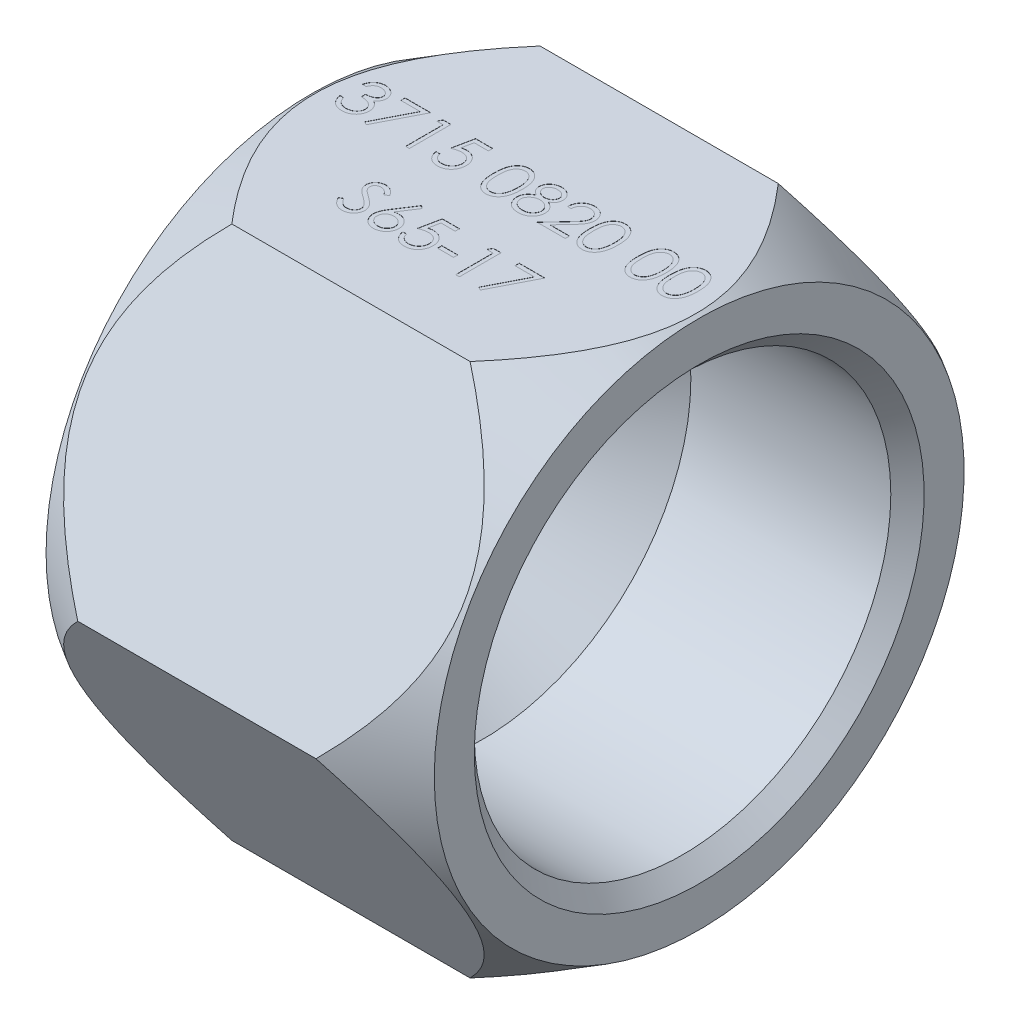
from build123d import *

# Parameters (mm, degrees)
SKETCH2_OUTSIDE_W  = 50.456
SKETCH2_OUTSIDE_H  = 50.456
EXTRUDE1_DEPTH     = 23.3
CHAMFER1_SIZE      = 1
SKETCH3_W          = 0.961538461
SKETCH3_H          = 0.256410256
CUT_EXTRUDE1_DEPTH = 0.01


with BuildPart() as part:
    # Sketch1 → Revolve1 (revolve)
    with BuildSketch(Plane.XY, mode=Mode.PRIVATE) as revolve1_sk:
        Polygon((0, 0), (0, 15.9), (4.5, 18.5), (18.8, 18.5), (23.3, 15.9), (23.3, 12.5), (10.3, 12.5), (3.3, 7.225121649), (3.3, 0), align=None)
    revolve(revolve1_sk.sketch.rotate(Axis((0, 0, 0), (1, 0, 0)), 90), axis=Axis((0, 0, 0), (1, 0, 0)))

    # Sketch2 outside → Extrude1 (cut)
    with BuildSketch(Plane(origin=(23.3, 0, 0), x_dir=(0, 0, -1), z_dir=(1, 0, 0))):
        Rectangle(SKETCH2_OUTSIDE_W, SKETCH2_OUTSIDE_H)
        Polygon((9.25, 16.02146997), (-9.25, 16.02146997), (-18.5, 0), (-9.25, -16.02146997), (9.25, -16.02146997), (18.5, 0), align=None, mode=Mode.SUBTRACT)
    extrude(amount=-EXTRUDE1_DEPTH, mode=Mode.SUBTRACT)

    # Chamfer1
    chamfer1_edges = [part.edges().sort_by_distance(p)[0] for p in [
        (23.3, 0, -12.5),
    ]]
    chamfer(chamfer1_edges, length=CHAMFER1_SIZE)

    # Sketch3 → Cut-Extrude1 (cut)
    # profile 1 of 16: a face of its own
    with BuildSketch(Plane(origin=(0, 16.02146997, 0), x_dir=(1, 0, 0), z_dir=(0, 1, 0))):
        with BuildLine():
            Line((1.384625306, 1.923076923), (1.160266332, 1.923076923))
            add(Edge.make_bspline(
                [(1.160266332, 1.923076923), (1.166344582, 1.948242983), (1.178227065, 1.997440572), (1.203011046, 2.067731473), (1.230010514, 2.134248274), (1.262431303, 2.195745469), (1.297794699, 2.253458971), (1.338310928, 2.306079774), (1.38211073, 2.354946178), (1.430557123, 2.398312776), (1.481363309, 2.437582583), (1.535245181, 2.471064767), (1.591118676, 2.499867733), (1.649370914, 2.52359647), (1.710175322, 2.541471844), (1.772982196, 2.554440991), (1.837956125, 2.562863215), (1.882061547, 2.563685189), (1.904457037, 2.564102564)],
                knots=[0, 0, 0, 0, 1.162005537, 2.271625781, 3.343758855, 4.383309926, 5.390229558, 6.379919256, 7.361854164, 8.333198761, 9.295911338, 10.242430842, 11.177959212, 12.116337295, 13.062827104, 14.020064771, 14.994644689, 16, 16, 16, 16], degree=3))
            add(Edge.make_bspline(
                [(1.904457037, 2.564102564), (1.937087567, 2.5631174), (2.00163686, 2.56116856), (2.096467608, 2.543372534), (2.187915336, 2.515211725), (2.274979085, 2.47630192), (2.355849394, 2.428310982), (2.427803813, 2.371193313), (2.489867035, 2.306050955), (2.541934447, 2.234099123), (2.582702304, 2.157202331), (2.612763999, 2.078059361), (2.6310652, 1.996857953), (2.633437026, 1.942031325), (2.634625306, 1.914563301)],
                knots=[0, 0, 0, 0, 1.083050992, 2.142477498, 3.193116406, 4.255571735, 5.30263384, 6.308962982, 7.297363603, 8.282367274, 9.249857812, 10.179914175, 11.08814088, 12, 12, 12, 12], degree=3))
            add(Edge.make_bspline(
                [(2.634625306, 1.914563301), (2.63379417, 1.888129876), (2.632167765, 1.836403766), (2.618357975, 1.760888411), (2.595117787, 1.689715839), (2.5629251, 1.622586438), (2.521252564, 1.559925838), (2.470772066, 1.501593059), (2.411127307, 1.447329374), (2.365928066, 1.416244037), (2.342658159, 1.400240385)],
                knots=[0, 0, 0, 0, 1.024540389, 2.004866551, 2.965041327, 3.920577974, 4.882998113, 5.874504559, 6.905732034, 8, 8, 8, 8], degree=3))
            add(Edge.make_bspline(
                [(2.342658159, 1.400240385), (2.369252269, 1.387398834), (2.421942894, 1.361956007), (2.4937647, 1.312059037), (2.558963183, 1.25444736), (2.595322982, 1.209488323), (2.613591652, 1.186899038)],
                knots=[0, 0, 0, 0, 1.015518401, 2.012035669, 3.001164323, 4, 4, 4, 4], degree=3))
            add(Edge.make_bspline(
                [(2.613591652, 1.186899038), (2.625621182, 1.170429216), (2.649483251, 1.137759275), (2.678937204, 1.085233257), (2.705658, 1.03212505), (2.726479585, 0.977011189), (2.742603776, 0.920530465), (2.754129513, 0.862585896), (2.761289613, 0.803130166), (2.762315008, 0.762906966), (2.762830434, 0.742688301)],
                knots=[0, 0, 0, 0, 1.025084078, 2.033381695, 3.024893161, 4.013698104, 4.991890475, 5.976764909, 6.982997093, 8, 8, 8, 8], degree=3))
            add(Edge.make_bspline(
                [(2.762830434, 0.742688301), (2.761548639, 0.707681358), (2.75899108, 0.637832213), (2.736131027, 0.534635984), (2.700692998, 0.433760625), (2.650366615, 0.337278597), (2.58903268, 0.247006896), (2.516063163, 0.166238104), (2.432287157, 0.096810529), (2.338854551, 0.038803224), (2.237628031, -0.007566721), (2.129359751, -0.039750608), (2.015609712, -0.060712037), (1.937604499, -0.0629598), (1.89794662, -0.064102564)],
                knots=[0, 0, 0, 0, 0.955779014, 1.907060117, 2.875433937, 3.871313158, 4.872415639, 5.851225146, 6.836215519, 7.83643374, 8.849228613, 9.86973379, 10.916971861, 12, 12, 12, 12], degree=3))
            add(Edge.make_bspline(
                [(1.89794662, -0.064102564), (1.871218549, -0.063482412), (1.818626616, -0.062262159), (1.741309832, -0.053920301), (1.667508618, -0.038684583), (1.597123191, -0.018182222), (1.530091022, 0.00781188), (1.466616661, 0.040182378), (1.406309594, 0.078262023), (1.349738915, 0.1225003), (1.296911367, 0.171986971), (1.249230849, 0.227600549), (1.205902426, 0.288312981), (1.168086255, 0.354829449), (1.134059861, 0.426290348), (1.106073463, 0.503610704), (1.081440914, 0.586099291), (1.06998844, 0.643583391), (1.064112486, 0.673076923)],
                knots=[0, 0, 0, 0, 1.048658725, 2.063410685, 3.046034179, 4.001477787, 4.936774919, 5.862367409, 6.792675028, 7.730719943, 8.675894397, 9.627829632, 10.600096036, 11.597688215, 12.626045268, 13.701542398, 14.82072376, 16, 16, 16, 16], degree=3))
            Line((1.064112486, 0.673076923), (1.28847146, 0.673076923))
            add(Edge.make_bspline(
                [(1.28847146, 0.673076923), (1.294316668, 0.653827628), (1.305686106, 0.616386077), (1.325039176, 0.562500144), (1.347087942, 0.513101535), (1.370741198, 0.467827876), (1.395582945, 0.426233303), (1.42337932, 0.389417682), (1.452071566, 0.355763966), (1.473699676, 0.336803529), (1.484284761, 0.327524038)],
                knots=[0, 0, 0, 0, 1.198163088, 2.33053128, 3.407730985, 4.417276592, 5.372219308, 6.28897303, 7.162600585, 8, 8, 8, 8], degree=3))
            add(Edge.make_bspline(
                [(1.484284761, 0.327524038), (1.498282316, 0.316732371), (1.526234218, 0.295182349), (1.571782954, 0.267681185), (1.619686444, 0.243851882), (1.67098264, 0.225649242), (1.724564619, 0.210236627), (1.781298452, 0.200150542), (1.840683607, 0.19323042), (1.881232009, 0.192619754), (1.90195303, 0.192307692)],
                knots=[0, 0, 0, 0, 0.946170439, 1.889420265, 2.845303464, 3.807233317, 4.801018734, 5.828864929, 6.890507805, 8, 8, 8, 8], degree=3))
            add(Edge.make_bspline(
                [(1.90195303, 0.192307692), (1.925348389, 0.192747625), (1.971095994, 0.193607874), (2.037849465, 0.201519093), (2.101354785, 0.213040817), (2.160906875, 0.230835805), (2.217285809, 0.252822128), (2.269701273, 0.280428131), (2.318841349, 0.312817218), (2.364076638, 0.349630903), (2.404752001, 0.389931971), (2.440565939, 0.432084165), (2.471012125, 0.475909757), (2.495571824, 0.521651272), (2.514965074, 0.569119293), (2.528167361, 0.618447028), (2.537347014, 0.66923079), (2.538094594, 0.703751482), (2.53847146, 0.721153846)],
                knots=[0, 0, 0, 0, 1.217147791, 2.380027433, 3.494444702, 4.572153297, 5.609568379, 6.639424714, 7.649109417, 8.668170816, 9.669597737, 10.625200337, 11.543417969, 12.441394052, 13.322311151, 14.205496177, 15.095365482, 16, 16, 16, 16], degree=3))
            add(Edge.make_bspline(
                [(2.53847146, 0.721153846), (2.537378387, 0.74444766), (2.535197681, 0.79091938), (2.518548696, 0.859289076), (2.491163793, 0.925162942), (2.452826285, 0.987417078), (2.406157907, 1.04511415), (2.351611545, 1.09659378), (2.288734239, 1.139072417), (2.230862904, 1.168421457), (2.179602078, 1.188447939), (2.135733946, 1.2017872), (2.086622087, 1.213082668), (2.032860409, 1.223591433), (1.974043826, 1.232535254), (1.91023637, 1.239993693), (1.841425112, 1.24596158), (1.793788565, 1.248626648), (1.769240691, 1.25)],
                knots=[0, 0, 0, 0, 1.07054697, 2.135767047, 3.216561865, 4.33974944, 5.486079747, 6.621378074, 7.775625952, 8.963672916, 9.598146892, 10.304877434, 11.070270905, 11.915000392, 12.823868403, 13.805723172, 14.86925407, 16, 16, 16, 16], degree=3))
            Line((1.769240691, 1.25), (1.769240691, 1.506410256))
            add(Edge.make_bspline(
                [(1.769240691, 1.506410256), (1.800170095, 1.506935116), (1.860753199, 1.507963188), (1.949249131, 1.520397481), (2.033872926, 1.537597929), (2.11274917, 1.563944495), (2.184641108, 1.594544707), (2.247012253, 1.630153428), (2.298988786, 1.669735392), (2.340318123, 1.713901542), (2.371410429, 1.761269433), (2.394143856, 1.810638474), (2.40757266, 1.862441375), (2.40936528, 1.897794709), (2.410266332, 1.915564904)],
                knots=[0, 0, 0, 0, 1.321986639, 2.589447074, 3.816329219, 5.01088745, 6.139805852, 7.153945165, 8.075214402, 8.924034688, 9.728124013, 10.488707548, 11.240355623, 12, 12, 12, 12], degree=3))
            add(Edge.make_bspline(
                [(2.410266332, 1.915564904), (2.409970324, 1.928620436), (2.40938143, 1.954593798), (2.401954803, 1.992540276), (2.390794774, 2.029326666), (2.37545211, 2.06479653), (2.354916254, 2.098703869), (2.330340549, 2.131337761), (2.301077621, 2.162511889), (2.267545159, 2.19156926), (2.231536726, 2.219261572), (2.192072601, 2.242771313), (2.150342691, 2.262874929), (2.106300795, 2.279453144), (2.059803987, 2.291924065), (2.011070732, 2.300878237), (1.960008101, 2.306476562), (1.925171149, 2.307282573), (1.907461845, 2.307692308)],
                knots=[0, 0, 0, 0, 0.884392785, 1.759457502, 2.611959086, 3.489218968, 4.37281399, 5.2945488, 6.255912374, 7.266815255, 8.301784654, 9.332968512, 10.37626691, 11.440494194, 12.520033166, 13.637162961, 14.798855837, 16, 16, 16, 16], degree=3))
            add(Edge.make_bspline(
                [(1.907461845, 2.307692308), (1.878996367, 2.306698478), (1.82339667, 2.304757297), (1.743243158, 2.287755144), (1.668729348, 2.260627942), (1.611773157, 2.228247213), (1.569714176, 2.196282618), (1.53965922, 2.168366628), (1.51014457, 2.137343182), (1.483111943, 2.101301485), (1.455773389, 2.06268235), (1.430884416, 2.019522577), (1.406698922, 1.97294801), (1.392125672, 1.940022556), (1.384625306, 1.923076923)],
                knots=[0, 0, 0, 0, 1.472543308, 2.876219568, 4.221790263, 5.565193594, 6.249813518, 6.953379497, 7.687249741, 8.463570142, 9.283606569, 10.136032583, 11.040678096, 12, 12, 12, 12], degree=3))
        make_face()
    # profile 2 of 16: a face of its own
    with BuildSketch(Plane(origin=(0, 16.02146997, 0), x_dir=(1, 0, 0), z_dir=(0, 1, 0))):
        Polygon((3.147445819, 2.5), (4.685907357, 2.5), (3.371804793, -0.064102564), (3.177994697, 0.042568109), (4.306299986, 2.243589744), (3.147445819, 2.243589744), align=None)
    # profile 3 of 16: a face of its own
    with BuildSketch(Plane(origin=(0, 16.02146997, 0), x_dir=(1, 0, 0), z_dir=(0, 1, 0))):
        Polygon((5.441616492, 2.5), (5.903856075, 2.5), (5.903856075, 0), (5.679497101, 0), (5.679497101, 2.243589744), (5.294881716, 2.243589744), align=None)
    # profile 4 of 16: a face of its own
    with BuildSketch(Plane(origin=(0, 16.02146997, 0), x_dir=(1, 0, 0), z_dir=(0, 1, 0))):
        with BuildLine():
            Line((8.403856075, 2.5), (8.403856075, 2.243589744))
            Line((8.403856075, 2.243589744), (7.553495498, 2.243589744))
            Line((7.553495498, 2.243589744), (7.418779954, 1.58603766))
            add(Edge.make_bspline(
                [(7.418779954, 1.58603766), (7.445248435, 1.593344997), (7.496526932, 1.607501807), (7.572212547, 1.623220214), (7.644064121, 1.632695532), (7.690689386, 1.633989325), (7.713251107, 1.634615385)],
                knots=[0, 0, 0, 0, 1.100273476, 2.13160584, 3.095893838, 4, 4, 4, 4], degree=3))
            add(Edge.make_bspline(
                [(7.713251107, 1.634615385), (7.741168064, 1.634011145), (7.796059777, 1.632823058), (7.87637331, 1.621414595), (7.953039663, 1.603457513), (8.025898498, 1.578371426), (8.095084606, 1.546293045), (8.159961436, 1.506221659), (8.221502802, 1.459412137), (8.278604655, 1.405594271), (8.330407732, 1.346364545), (8.375954868, 1.282680351), (8.414642432, 1.215160592), (8.445757257, 1.143160158), (8.47060321, 1.067475048), (8.487140349, 0.987308918), (8.498152284, 0.903417403), (8.49938256, 0.846056996), (8.500009921, 0.816806891)],
                knots=[0, 0, 0, 0, 1.052922333, 2.070308379, 3.05430497, 4.020497103, 4.973039431, 5.925935799, 6.892292201, 7.88610001, 8.88166317, 9.857072816, 10.836096531, 11.812156883, 12.81219415, 13.836441305, 14.89672472, 16, 16, 16, 16], degree=3))
            add(Edge.make_bspline(
                [(8.500009921, 0.816806891), (8.499534868, 0.796433876), (8.49859118, 0.755963171), (8.493792189, 0.695860171), (8.484552392, 0.637029576), (8.472146875, 0.579463581), (8.456045147, 0.523271173), (8.436552966, 0.46829151), (8.412698661, 0.414866791), (8.386533393, 0.362491509), (8.357071623, 0.312349718), (8.324372689, 0.265457584), (8.289825909, 0.221111669), (8.252653491, 0.179787574), (8.212509923, 0.141756847), (8.169881375, 0.106793789), (8.125108005, 0.074307124), (8.077497117, 0.045615556), (8.02810963, 0.019213445), (7.976232332, -0.002446225), (7.923046117, -0.021810888), (7.867785492, -0.037246264), (7.810575625, -0.049340946), (7.751322214, -0.057555661), (7.690336021, -0.063538831), (7.648996727, -0.063913371), (7.628114889, -0.064102564)],
                knots=[0, 0, 0, 0, 1.056347294, 2.098418968, 3.122841568, 4.141288669, 5.149314143, 6.15115421, 7.162517403, 8.180376062, 9.185164535, 10.17417709, 11.141909838, 12.097768115, 13.052685741, 14.0056014, 14.954263652, 15.917497458, 16.885230207, 17.854509472, 18.828990115, 19.81800267, 20.826176721, 21.857883937, 22.917946725, 24, 24, 24, 24], degree=3))
            add(Edge.make_bspline(
                [(7.628114889, -0.064102564), (7.60320476, -0.063609108), (7.554197024, -0.062638293), (7.482396619, -0.052482232), (7.413314758, -0.037936577), (7.347507543, -0.016053527), (7.284385212, 0.011365969), (7.224797556, 0.046020377), (7.167222002, 0.085291166), (7.113999118, 0.131634275), (7.064601894, 0.182288333), (7.020382959, 0.237258077), (6.981001833, 0.29563625), (6.947089157, 0.35770636), (6.918161999, 0.423305311), (6.895437007, 0.492678883), (6.877095325, 0.5654646), (6.869335739, 0.61557425), (6.865394537, 0.641025641)],
                knots=[0, 0, 0, 0, 1.0467383, 2.05933395, 3.04377827, 4.011590433, 4.970194871, 5.932262533, 6.905835911, 7.896367577, 8.894135286, 9.877477877, 10.858688626, 11.851381753, 12.8477658, 13.868841284, 14.917554742, 16, 16, 16, 16], degree=3))
            Line((6.865394537, 0.641025641), (7.089753511, 0.641025641))
            add(Edge.make_bspline(
                [(7.089753511, 0.641025641), (7.095273909, 0.617185318), (7.105884421, 0.571362893), (7.129174242, 0.506983363), (7.157649867, 0.449612489), (7.191510116, 0.398491358), (7.231902995, 0.353913503), (7.277995444, 0.31418703), (7.329672389, 0.278347652), (7.387096125, 0.248474247), (7.447676895, 0.222996566), (7.511082045, 0.20603107), (7.57558515, 0.194101861), (7.619212557, 0.192907746), (7.641135723, 0.192307692)],
                knots=[0, 0, 0, 0, 1.136247022, 2.183929868, 3.172523383, 4.106158343, 5.02341133, 5.958108904, 6.928429099, 7.938127109, 8.96079061, 9.975095812, 10.982467395, 12, 12, 12, 12], degree=3))
            add(Edge.make_bspline(
                [(7.641135723, 0.192307692), (7.662534612, 0.192893962), (7.704669199, 0.194048333), (7.766677332, 0.202933341), (7.826543671, 0.216617321), (7.883677497, 0.237095789), (7.939078597, 0.261984873), (7.991345576, 0.293924213), (8.041990488, 0.330681369), (8.089439155, 0.372793248), (8.132895904, 0.419200172), (8.171293134, 0.468826882), (8.203276643, 0.521767487), (8.230229578, 0.577105453), (8.25069622, 0.635447279), (8.265296921, 0.696519547), (8.273870535, 0.760473105), (8.275049949, 0.80409404), (8.275650947, 0.826322115)],
                knots=[0, 0, 0, 0, 1.027316725, 2.022795036, 3.002884548, 3.971462791, 4.93288096, 5.914575861, 6.907176829, 7.935150275, 8.956128384, 9.956726525, 10.942570165, 11.921478529, 12.907843606, 13.90538589, 14.932640048, 16, 16, 16, 16], degree=3))
            add(Edge.make_bspline(
                [(8.275650947, 0.826322115), (8.275180605, 0.846376224), (8.274259976, 0.885629287), (8.26673814, 0.943057292), (8.253654589, 0.997395179), (8.235494674, 1.048905346), (8.212437883, 1.097636377), (8.184261946, 1.143638562), (8.15043809, 1.186305586), (8.111801027, 1.22565741), (8.069473855, 1.261975178), (8.022728324, 1.29293524), (7.972542662, 1.318980895), (7.91952152, 1.341458037), (7.862403735, 1.357601426), (7.802320426, 1.369721345), (7.738622778, 1.376732318), (7.695072286, 1.377705095), (7.672686204, 1.378205128)],
                knots=[0, 0, 0, 0, 1.045622112, 2.046656509, 3.013763289, 3.955457236, 4.890082067, 5.820317437, 6.762574623, 7.722996705, 8.69280354, 9.665887285, 10.63943826, 11.638615906, 12.663482002, 13.728887084, 14.832589034, 16, 16, 16, 16], degree=3))
            add(Edge.make_bspline(
                [(7.672686204, 1.378205128), (7.653308397, 1.37779042), (7.613298143, 1.376934153), (7.551924696, 1.370629513), (7.487430608, 1.360458588), (7.420063111, 1.346468412), (7.349619891, 1.3281605), (7.276249605, 1.306221571), (7.199797986, 1.279991571), (7.148285326, 1.260182847), (7.121804793, 1.25)],
                knots=[0, 0, 0, 0, 0.817624296, 1.688186739, 2.600797293, 3.572016777, 4.590301741, 5.671205678, 6.80286297, 8, 8, 8, 8], degree=3))
            Line((7.121804793, 1.25), (7.37821505, 2.5))
            Line((7.37821505, 2.5), (8.403856075, 2.5))
        make_face()
    # profile 5 of 16: a face of its own
    with BuildSketch(Plane(origin=(0, 16.02146997, 0), x_dir=(1, 0, 0), z_dir=(0, 1, 0))):
        with BuildLine():
            add(Edge.make_bspline(
                [(9.717958639, 1.248998397), (9.718192938, 1.28906796), (9.718648067, 1.366903663), (9.723711224, 1.480321265), (9.732122183, 1.586721471), (9.743648878, 1.686109375), (9.757676007, 1.778510636), (9.776401354, 1.863678319), (9.797696213, 1.94200661), (9.822376532, 2.01375093), (9.850224953, 2.079877861), (9.880535139, 2.141610148), (9.914509992, 2.198854385), (9.950207787, 2.252524235), (9.989073552, 2.30174116), (10.03000126, 2.347200205), (10.074588314, 2.387850741), (10.121319035, 2.424883814), (10.170616509, 2.457347722), (10.221075556, 2.485942536), (10.273043489, 2.510371012), (10.326662191, 2.529578466), (10.381449733, 2.545443357), (10.437597637, 2.556292605), (10.495198612, 2.563118968), (10.534078208, 2.563771588), (10.553795979, 2.564102564)],
                knots=[0, 0, 0, 0, 1.646270934, 3.197905019, 4.663502075, 6.030701355, 7.308322542, 8.50163776, 9.611534131, 10.641858119, 11.616356847, 12.558055219, 13.465016945, 14.349605745, 15.204443733, 16.039544428, 16.859896111, 17.680448484, 18.487036065, 19.28249412, 20.06191084, 20.843045899, 21.620316918, 22.403196591, 23.190181807, 24, 24, 24, 24], degree=3))
            add(Edge.make_bspline(
                [(10.553795979, 2.564102564), (10.573678464, 2.563754125), (10.61321847, 2.563061188), (10.671675881, 2.556401229), (10.728782797, 2.545350427), (10.784295753, 2.529692588), (10.838670743, 2.510267105), (10.891482463, 2.485919164), (10.94305895, 2.457577116), (10.992580584, 2.424274346), (11.040591023, 2.387144149), (11.085910997, 2.345170814), (11.12854463, 2.298778158), (11.169026991, 2.248462541), (11.20620956, 2.193258909), (11.241619154, 2.134127402), (11.273313466, 2.070033927), (11.303838234, 2.002047878), (11.330186081, 1.928288122), (11.353947685, 1.849170436), (11.373146948, 1.763760302), (11.389139286, 1.672505842), (11.401528497, 1.575071925), (11.410551813, 1.471667414), (11.415318302, 1.362224278), (11.416215946, 1.287397243), (11.416676588, 1.248998397)],
                knots=[0, 0, 0, 0, 0.810914788, 1.612654377, 2.396697861, 3.181598691, 3.963628158, 4.749916497, 5.551656086, 6.361998678, 7.18212741, 8.025565596, 8.878627764, 9.750805457, 10.657531673, 11.591944965, 12.560506719, 13.57287815, 14.630710178, 15.753379473, 16.941251878, 18.199788006, 19.531962791, 20.947069417, 22.433333509, 24, 24, 24, 24], degree=3))
            add(Edge.make_bspline(
                [(11.416676588, 1.248998397), (11.416211171, 1.210767035), (11.415304324, 1.136274783), (11.410605247, 1.027324087), (11.401349082, 0.924468341), (11.389770519, 0.827460868), (11.373734117, 0.736705426), (11.354016141, 0.651887963), (11.332123053, 0.572642198), (11.3050982, 0.499617332), (11.275519122, 0.431794673), (11.243336839, 0.368460996), (11.208858391, 0.309056501), (11.171295002, 0.254056682), (11.13125685, 0.203071926), (11.087887001, 0.157002196), (11.042408011, 0.11473743), (10.994256286, 0.077129125), (10.943962321, 0.044211407), (10.89256298, 0.014772943), (10.839146277, -0.008964696), (10.78492274, -0.029346869), (10.729116764, -0.04491862), (10.671797914, -0.05568566), (10.613257745, -0.06323698), (10.573685199, -0.063813037), (10.553795979, -0.064102564)],
                knots=[0, 0, 0, 0, 1.561518951, 3.042555995, 4.452378317, 5.7783523, 7.031515105, 8.214008947, 9.334062868, 10.386615937, 11.391082383, 12.354592575, 13.286541444, 14.194233754, 15.072674879, 15.931287219, 16.775624067, 17.606195743, 18.42308326, 19.229000347, 20.022332153, 20.807536673, 21.593273796, 22.3848459, 23.188221202, 24, 24, 24, 24], degree=3))
            add(Edge.make_bspline(
                [(10.553795979, -0.064102564), (10.534078755, -0.063769453), (10.495200237, -0.063112623), (10.437591362, -0.056317101), (10.381675331, -0.045391741), (10.327176221, -0.030094167), (10.273814424, -0.011369284), (10.222317077, 0.013026205), (10.172111588, 0.041121968), (10.123331906, 0.073118698), (10.076894648, 0.109777043), (10.032538501, 0.150322963), (9.991377773, 0.195768257), (9.953067705, 0.245395345), (9.916657642, 0.298747661), (9.883165232, 0.356553642), (9.852186051, 0.418584078), (9.823869272, 0.485239728), (9.798763083, 0.557493248), (9.776586149, 0.636171233), (9.759076037, 0.721968116), (9.744088211, 0.814194807), (9.731999366, 0.913247614), (9.723746277, 1.019180313), (9.718645338, 1.13192689), (9.718191716, 1.209262444), (9.717958639, 1.248998397)],
                knots=[0, 0, 0, 0, 0.810891512, 1.598919785, 2.382837074, 3.152667961, 3.926044502, 4.706494248, 5.493654104, 6.291793342, 7.103789334, 7.925228297, 8.761435821, 9.622817696, 10.50288917, 11.416980706, 12.369136599, 13.353924996, 14.394355917, 15.514179734, 16.714354668, 17.994756427, 19.357759367, 20.818452758, 22.365282078, 24, 24, 24, 24], degree=3))
        make_face()
        with BuildLine():
            add(Edge.make_bspline(
                [(9.942317614, 1.25), (9.942402933, 1.216608072), (9.942568521, 1.151800897), (9.946894379, 1.05762714), (9.952787402, 0.96979119), (9.960388328, 0.888181522), (9.971676149, 0.81307437), (9.984323854, 0.743953168), (9.999715347, 0.681183712), (10.017926074, 0.624335276), (10.038668286, 0.572443084), (10.061315331, 0.524156502), (10.085644419, 0.478905119), (10.112872384, 0.437095399), (10.142526, 0.398590996), (10.173935471, 0.362710401), (10.208273031, 0.330712558), (10.255775705, 0.292336233), (10.318487472, 0.252679708), (10.397502083, 0.218146787), (10.478693834, 0.196445033), (10.533801869, 0.193685207), (10.561307998, 0.192307692)],
                knots=[0, 0, 0, 0, 1.459021318, 2.831673884, 4.118529203, 5.306027144, 6.411944654, 7.436330062, 8.375795394, 9.233974572, 10.042671642, 10.816086306, 11.563610507, 12.285937304, 12.993564865, 13.685989202, 14.367179055, 15.041617293, 16.353048772, 17.594441528, 18.799311195, 20, 20, 20, 20], degree=3))
            add(Edge.make_bspline(
                [(10.561307998, 0.192307692), (10.58899205, 0.193448964), (10.644302995, 0.195729152), (10.725112848, 0.21772825), (10.803563041, 0.250920778), (10.865042999, 0.290168997), (10.911816244, 0.327546375), (10.94532838, 0.359413981), (10.976086986, 0.395096743), (11.005259896, 0.43359624), (11.032016379, 0.475648014), (11.056347192, 0.521049854), (11.078549583, 0.569927838), (11.091198901, 0.60404908), (11.097666171, 0.621494391)],
                knots=[0, 0, 0, 0, 1.353760809, 2.704726607, 4.075137775, 5.516104923, 6.260822281, 7.007110065, 7.778089737, 8.566572457, 9.372053459, 10.217411131, 11.088608312, 12, 12, 12, 12], degree=3))
            add(Edge.make_bspline(
                [(11.097666171, 0.621494391), (11.105203148, 0.643801348), (11.120506444, 0.689094037), (11.14022914, 0.759353788), (11.155761568, 0.833070048), (11.169735401, 0.909802274), (11.179273298, 0.990116346), (11.186950307, 1.073763763), (11.191472226, 1.160807594), (11.192032763, 1.219946873), (11.192317614, 1.25)],
                knots=[0, 0, 0, 0, 0.884706709, 1.796334032, 2.740027952, 3.714592787, 4.726048262, 5.777819803, 6.87074269, 8, 8, 8, 8], degree=3))
            add(Edge.make_bspline(
                [(11.192317614, 1.25), (11.191924621, 1.280048266), (11.191155845, 1.338829098), (11.188217282, 1.424913513), (11.180629014, 1.506676199), (11.172201072, 1.584469394), (11.159774486, 1.657862467), (11.146376052, 1.727469828), (11.128375186, 1.792429132), (11.109146776, 1.853757404), (11.08713935, 1.910757872), (11.062913826, 1.963696291), (11.037041141, 2.012828237), (11.008939541, 2.058018909), (10.978942624, 2.099470726), (10.946258661, 2.136352579), (10.912184109, 2.169807556), (10.864457547, 2.207995106), (10.801975912, 2.246932031), (10.724229021, 2.282764717), (10.643321418, 2.303342068), (10.588626093, 2.306243274), (10.561307998, 2.307692308)],
                knots=[0, 0, 0, 0, 1.31362396, 2.569729283, 3.763502607, 4.902122613, 5.988968491, 7.01645872, 7.998833611, 8.933434873, 9.825090667, 10.667526885, 11.477055099, 12.250526234, 12.991942729, 13.710640831, 14.402115721, 15.076753259, 16.378508321, 17.609869233, 18.806226677, 20, 20, 20, 20], degree=3))
            add(Edge.make_bspline(
                [(10.561307998, 2.307692308), (10.533657575, 2.306241274), (10.478306357, 2.303336564), (10.396557818, 2.282841383), (10.318197567, 2.247117836), (10.255881156, 2.207866141), (10.208121309, 2.170481633), (10.174490814, 2.138062738), (10.142957834, 2.102601127), (10.113909476, 2.063742617), (10.086702845, 2.02198164), (10.061716408, 1.976989665), (10.03920403, 1.928538691), (10.018429361, 1.876669808), (10.000163084, 1.819826277), (9.985095967, 1.757134138), (9.971176643, 1.688232787), (9.96132288, 1.612718853), (9.952563054, 1.531088743), (9.94693352, 1.443033516), (9.94255405, 1.348701816), (9.942398005, 1.28355956), (9.942317614, 1.25)],
                knots=[0, 0, 0, 0, 1.207732386, 2.417664972, 3.655092373, 4.956220595, 5.625982001, 6.301752483, 6.994047911, 7.697131622, 8.419323945, 9.170223765, 9.943494443, 10.752040957, 11.610060368, 12.549350801, 13.567764191, 14.679664412, 15.874934091, 17.154273443, 18.533957287, 20, 20, 20, 20], degree=3))
        make_face(mode=Mode.SUBTRACT)
    # profile 6 of 16: a face of its own
    with BuildSketch(Plane(origin=(0, 16.02146997, 0), x_dir=(1, 0, 0), z_dir=(0, 1, 0))):
        with BuildLine():
            add(Edge.make_bspline(
                [(12.856480274, 1.392728365), (12.876943522, 1.382058397), (12.91685369, 1.361248395), (12.973694553, 1.327740661), (13.025640982, 1.292425686), (13.07413424, 1.256971501), (13.118322348, 1.220020321), (13.157711215, 1.181425209), (13.1932738, 1.142149534), (13.224292932, 1.10152822), (13.251576386, 1.059669185), (13.275156483, 1.016462561), (13.295311628, 0.972003037), (13.311285156, 0.925805301), (13.324443578, 0.878547972), (13.333497582, 0.829620842), (13.338366809, 0.779346312), (13.33928739, 0.745368954), (13.339753511, 0.728165064)],
                knots=[0, 0, 0, 0, 1.272397273, 2.481599622, 3.635517121, 4.734568067, 5.792894095, 6.808321871, 7.773003508, 8.711915296, 9.623354172, 10.525449501, 11.423591555, 12.311487226, 13.218079475, 14.126165749, 15.051214107, 16, 16, 16, 16], degree=3))
            add(Edge.make_bspline(
                [(13.339753511, 0.728165064), (13.339202497, 0.704095255), (13.338111832, 0.656452072), (13.328611843, 0.586133421), (13.314388287, 0.517839291), (13.293617207, 0.451584654), (13.266679071, 0.387735102), (13.233481331, 0.326235978), (13.195901898, 0.266079329), (13.165721727, 0.22906547), (13.150450627, 0.210336538)],
                knots=[0, 0, 0, 0, 1.025265484, 2.029385089, 3.018602448, 3.995076438, 4.983346944, 5.966715145, 6.97116228, 8, 8, 8, 8], degree=3))
            add(Edge.make_bspline(
                [(13.150450627, 0.210336538), (13.130567431, 0.188483843), (13.091046741, 0.145048491), (13.02334465, 0.088655055), (12.949043304, 0.041262631), (12.868430209, 0.002639849), (12.781720851, -0.027421479), (12.688933705, -0.049023277), (12.589887882, -0.061396441), (12.521812545, -0.063185005), (12.486888928, -0.064102564)],
                knots=[0, 0, 0, 0, 0.954267603, 1.896743057, 2.838368354, 3.796610408, 4.779680527, 5.799409237, 6.871065594, 8, 8, 8, 8], degree=3))
            add(Edge.make_bspline(
                [(12.486888928, -0.064102564), (12.453307936, -0.063279366), (12.387962737, -0.061677505), (12.292849967, -0.050824339), (12.204190631, -0.031804435), (12.121469226, -0.005772571), (12.045184445, 0.028091878), (11.975553658, 0.070240741), (11.911572249, 0.118977486), (11.855181911, 0.175701827), (11.805118737, 0.23645745), (11.761141556, 0.299137172), (11.724588643, 0.363746713), (11.693640718, 0.429322689), (11.669949273, 0.496784228), (11.653540551, 0.565784237), (11.643119613, 0.636202197), (11.641733088, 0.683724806), (11.641035562, 0.707632212)],
                knots=[0, 0, 0, 0, 1.256902934, 2.445805442, 3.576955095, 4.645999104, 5.686449165, 6.692658513, 7.68621702, 8.689161843, 9.678783111, 10.630372946, 11.551080876, 12.453998257, 13.34127905, 14.221779781, 15.105423033, 16, 16, 16, 16], degree=3))
            add(Edge.make_bspline(
                [(11.641035562, 0.707632212), (11.641448335, 0.725174492), (11.642264118, 0.759844229), (11.647910438, 0.811065177), (11.656987911, 0.860919559), (11.669316094, 0.909591519), (11.68602397, 0.956726714), (11.706196922, 1.002548481), (11.729719746, 1.047108551), (11.756920578, 1.090650609), (11.788564881, 1.132564547), (11.824396059, 1.173561686), (11.865130251, 1.213005876), (11.910314293, 1.251379037), (11.959431821, 1.289361876), (12.013758629, 1.324901682), (12.071854534, 1.360514514), (12.11314411, 1.381806175), (12.134324825, 1.392728365)],
                knots=[0, 0, 0, 0, 0.941657376, 1.861047343, 2.762797495, 3.66048619, 4.553285746, 5.444104102, 6.34607688, 7.256116206, 8.197091036, 9.162375105, 10.176350973, 11.237807142, 12.343728897, 13.50695164, 14.721116704, 16, 16, 16, 16], degree=3))
            add(Edge.make_bspline(
                [(12.134324825, 1.392728365), (12.105330986, 1.408538914), (12.049190799, 1.439152563), (11.974855483, 1.495400281), (11.911005038, 1.556320149), (11.859394526, 1.623198574), (11.818771505, 1.693946341), (11.790901074, 1.768120807), (11.772046442, 1.844346603), (11.770178709, 1.896422457), (11.769240691, 1.922576122)],
                knots=[0, 0, 0, 0, 1.166880483, 2.259407225, 3.286803203, 4.280235371, 5.237608625, 6.161067461, 7.076446754, 8, 8, 8, 8], degree=3))
            add(Edge.make_bspline(
                [(11.769240691, 1.922576122), (11.770408851, 1.949217235), (11.772757056, 2.002770518), (11.791745142, 2.082489178), (11.822688047, 2.160786724), (11.864774473, 2.237283662), (11.917193914, 2.309390958), (11.980084303, 2.374063063), (12.051943801, 2.430714122), (12.132413706, 2.478268531), (12.219011017, 2.516971144), (12.310379392, 2.543670018), (12.404926887, 2.561124387), (12.469282401, 2.563100569), (12.501912966, 2.564102564)],
                knots=[0, 0, 0, 0, 0.888701115, 1.786444228, 2.72001202, 3.692817113, 4.693886446, 5.687152267, 6.695133018, 7.739871481, 8.800368666, 9.853104506, 10.91144658, 12, 12, 12, 12], degree=3))
            add(Edge.make_bspline(
                [(12.501912966, 2.564102564), (12.533701406, 2.563069462), (12.596384586, 2.561032302), (12.688523606, 2.544041675), (12.776684233, 2.515663446), (12.860562446, 2.47716543), (12.938656637, 2.429746186), (13.007658287, 2.372316991), (13.068610131, 2.307930169), (13.119027556, 2.235844738), (13.160572477, 2.159641742), (13.189501692, 2.07991137), (13.208038816, 1.998376328), (13.210376933, 1.943206325), (13.211548383, 1.915564904)],
                knots=[0, 0, 0, 0, 1.072916533, 2.115669174, 3.151510826, 4.193348718, 5.225979165, 6.227137561, 7.216255879, 8.211077061, 9.189680878, 10.138522389, 11.067357538, 12, 12, 12, 12], degree=3))
            add(Edge.make_bspline(
                [(13.211548383, 1.915564904), (13.210523697, 1.888438715), (13.208511271, 1.835164423), (13.191582743, 1.757502623), (13.163073234, 1.684772595), (13.124148831, 1.616149058), (13.07341634, 1.552876559), (13.01155296, 1.494150509), (12.939051904, 1.439488489), (12.884579842, 1.408641086), (12.856480274, 1.392728365)],
                knots=[0, 0, 0, 0, 0.975232327, 1.915300861, 2.843280834, 3.77672583, 4.742871857, 5.749627742, 6.839139064, 8, 8, 8, 8], degree=3))
        make_face()
        with BuildLine():
            add(Edge.make_bspline(
                [(12.489392934, 2.307692308), (12.471856644, 2.307226993), (12.437547994, 2.306316634), (12.3872418, 2.301560465), (12.339404395, 2.292308167), (12.293535966, 2.279994802), (12.250265385, 2.263360524), (12.209004989, 2.243792661), (12.170456997, 2.220002614), (12.134156066, 2.193316044), (12.101476941, 2.163963968), (12.07247369, 2.13338274), (12.04838218, 2.100971746), (12.027924245, 2.067537203), (12.013080304, 2.032086792), (12.001962944, 1.99570738), (11.994447664, 1.957939249), (11.993884528, 1.932127455), (11.993599665, 1.919070513)],
                knots=[0, 0, 0, 0, 1.203892937, 2.355340988, 3.463153438, 4.544400666, 5.610487187, 6.640501085, 7.674077295, 8.714426146, 9.728707835, 10.68524104, 11.601827946, 12.495867327, 13.368432065, 14.231010473, 15.105153427, 16, 16, 16, 16], degree=3))
            add(Edge.make_bspline(
                [(11.993599665, 1.919070513), (11.994090641, 1.906013006), (11.995060881, 1.880209497), (12.002564544, 1.842105307), (12.013748012, 1.804661281), (12.031355627, 1.768767773), (12.052474455, 1.733179659), (12.078539795, 1.698786383), (12.109603386, 1.665468251), (12.144622986, 1.63350865), (12.182774085, 1.603580962), (12.223191258, 1.577600118), (12.265367252, 1.555861468), (12.30886873, 1.537769036), (12.35413905, 1.523704795), (12.400900816, 1.513727191), (12.44916189, 1.507525764), (12.481862304, 1.506785035), (12.498407357, 1.506410256)],
                knots=[0, 0, 0, 0, 0.873023192, 1.725219244, 2.590779336, 3.480155217, 4.391973325, 5.357036234, 6.360879153, 7.436073238, 8.526419356, 9.601555421, 10.645666583, 11.697338044, 12.750135903, 13.812665442, 14.89329948, 16, 16, 16, 16], degree=3))
            add(Edge.make_bspline(
                [(12.498407357, 1.506410256), (12.519657432, 1.507033733), (12.561947694, 1.508274528), (12.624290074, 1.519811081), (12.684906248, 1.537958165), (12.743148323, 1.562786712), (12.797508741, 1.593949469), (12.845965933, 1.631258768), (12.88810657, 1.673853123), (12.923492721, 1.721069434), (12.950928325, 1.771320569), (12.972286759, 1.821749349), (12.984759056, 1.8728938), (12.986385889, 1.907155917), (12.987189409, 1.924078526)],
                knots=[0, 0, 0, 0, 1.076279235, 2.141928126, 3.20205304, 4.278698113, 5.344010996, 6.36967002, 7.368914609, 8.37248503, 9.349703398, 10.264243087, 11.142681841, 12, 12, 12, 12], degree=3))
            add(Edge.make_bspline(
                [(12.987189409, 1.924078526), (12.986809482, 1.935955694), (12.986055381, 1.959530171), (12.979841056, 1.994343289), (12.969572604, 2.02836442), (12.955670404, 2.061874614), (12.937377693, 2.094403708), (12.915688988, 2.126463057), (12.889342915, 2.157331459), (12.859774034, 2.18772828), (12.8262416, 2.215859725), (12.788810234, 2.240598804), (12.74767184, 2.26160763), (12.702825448, 2.278671026), (12.654436216, 2.29148699), (12.60272702, 2.301084382), (12.547266701, 2.306493747), (12.509102593, 2.307284122), (12.489392934, 2.307692308)],
                knots=[0, 0, 0, 0, 0.814439003, 1.616544685, 2.417341072, 3.248991801, 4.09997495, 4.973547432, 5.9003056, 6.880240646, 7.880314356, 8.896779544, 9.951930927, 11.043077905, 12.18215768, 13.381699519, 14.647792085, 16, 16, 16, 16], degree=3))
        make_face(mode=Mode.SUBTRACT)
        with BuildLine():
            add(Edge.make_bspline(
                [(12.503916171, 1.25), (12.481683468, 1.249604542), (12.438068327, 1.24882875), (12.374170521, 1.240193392), (12.312846832, 1.228172397), (12.25430402, 1.209936084), (12.198566808, 1.186224305), (12.145333463, 1.157699634), (12.095011228, 1.12398146), (12.048294995, 1.085498163), (12.005635474, 1.044027125), (11.968208117, 1.0001256), (11.936424173, 0.954609505), (11.910828994, 0.906900769), (11.889820614, 0.858009619), (11.876024988, 0.806718479), (11.867180908, 0.754013399), (11.865993314, 0.718184757), (11.865394537, 0.700120192)],
                knots=[0, 0, 0, 0, 1.140299081, 2.23698856, 3.303958914, 4.344563908, 5.37730929, 6.408454204, 7.439741482, 8.480804886, 9.510774543, 10.48932336, 11.43758569, 12.353841022, 13.263987381, 14.161954604, 15.073269652, 16, 16, 16, 16], degree=3))
            add(Edge.make_bspline(
                [(11.865394537, 0.700120192), (11.866368293, 0.677669545), (11.868300203, 0.633127986), (11.883626373, 0.56729722), (11.908223184, 0.503567895), (11.94252691, 0.442459358), (11.985003748, 0.385352139), (12.037236939, 0.335574442), (12.095980395, 0.291344815), (12.163221719, 0.255573005), (12.236670623, 0.227005251), (12.316307572, 0.207322421), (12.400989657, 0.194292814), (12.459460795, 0.192979827), (12.489392934, 0.192307692)],
                knots=[0, 0, 0, 0, 0.898778495, 1.783155532, 2.693654817, 3.627872908, 4.583023416, 5.533784346, 6.509005473, 7.520592997, 8.575161974, 9.658835044, 10.801527049, 12, 12, 12, 12], degree=3))
            add(Edge.make_bspline(
                [(12.489392934, 0.192307692), (12.512786054, 0.192756841), (12.558363353, 0.193631927), (12.624853317, 0.201356423), (12.687599423, 0.213606155), (12.746479993, 0.231422973), (12.802154165, 0.253172957), (12.853677989, 0.281153015), (12.902376937, 0.312976103), (12.94585131, 0.350731929), (12.985446459, 0.391074425), (13.01997024, 0.433781599), (13.049939919, 0.477692765), (13.07346203, 0.523800254), (13.092266497, 0.571219479), (13.105783322, 0.620387701), (13.114123476, 0.671455724), (13.114966973, 0.706097918), (13.115394537, 0.723657853)],
                knots=[0, 0, 0, 0, 1.224942928, 2.386581632, 3.501229538, 4.569074225, 5.605009692, 6.626002462, 7.634866581, 8.645888296, 9.63523824, 10.59253846, 11.518950513, 12.414518923, 13.29783783, 14.186679152, 15.080837789, 16, 16, 16, 16], degree=3))
            add(Edge.make_bspline(
                [(13.115394537, 0.723657853), (13.114747502, 0.740713096), (13.113471663, 0.774343056), (13.105374026, 0.82417629), (13.0911484, 0.872321157), (13.07162883, 0.919356875), (13.045642429, 0.964330412), (13.01503895, 1.008413391), (12.97811458, 1.05038228), (12.936391297, 1.090563063), (12.89092061, 1.127717161), (12.842586935, 1.160584617), (12.79176232, 1.1882647), (12.738554312, 1.210776482), (12.683081058, 1.228481818), (12.625383359, 1.240850386), (12.565393662, 1.248635816), (12.524640183, 1.249540135), (12.503916171, 1.25)],
                knots=[0, 0, 0, 0, 0.917430815, 1.809013306, 2.70690318, 3.612392954, 4.541220862, 5.495268465, 6.494511384, 7.542276156, 8.608045339, 9.649016899, 10.681629292, 11.715607085, 12.752076957, 13.808767841, 14.885711793, 16, 16, 16, 16], degree=3))
        make_face(mode=Mode.SUBTRACT)
    # profile 7 of 16: a face of its own
    with BuildSketch(Plane(origin=(0, 16.02146997, 0), x_dir=(1, 0, 0), z_dir=(0, 1, 0))):
        with BuildLine():
            Line((13.884625306, 1.730769231), (13.660266332, 1.730769231))
            add(Edge.make_bspline(
                [(13.660266332, 1.730769231), (13.661728584, 1.760534151), (13.664600408, 1.818991661), (13.678049186, 1.904223023), (13.69729267, 1.985690736), (13.724500851, 2.062740675), (13.75829105, 2.136054108), (13.798812498, 2.205339834), (13.846808105, 2.27033354), (13.901241487, 2.330432714), (13.960361943, 2.385566693), (14.0241519, 2.433177581), (14.091184062, 2.473404489), (14.161255062, 2.507033947), (14.235155464, 2.532276694), (14.312214648, 2.551006437), (14.392771174, 2.562275255), (14.447656904, 2.563486531), (14.475570819, 2.564102564)],
                knots=[0, 0, 0, 0, 1.10065271, 2.161652631, 3.183658789, 4.190468796, 5.17591951, 6.163126047, 7.15150782, 8.156236427, 9.156009102, 10.134482811, 11.092018607, 12.041330605, 13.001268258, 13.972401359, 14.968799086, 16, 16, 16, 16], degree=3))
            add(Edge.make_bspline(
                [(14.475570819, 2.564102564), (14.502983729, 2.563460809), (14.556849118, 2.562199785), (14.635464843, 2.551370478), (14.710305767, 2.534409341), (14.7812256, 2.510612615), (14.847658504, 2.478623738), (14.910103536, 2.440196925), (14.969304115, 2.395754188), (15.022594674, 2.343430036), (15.071529017, 2.28757119), (15.113744913, 2.227936973), (15.149897173, 2.166344626), (15.18003123, 2.102324482), (15.202214186, 2.035273748), (15.219055763, 1.966168603), (15.228575345, 1.894293738), (15.230036361, 1.845646198), (15.230779152, 1.820913462)],
                knots=[0, 0, 0, 0, 1.111607364, 2.184268762, 3.212621178, 4.221274766, 5.211760367, 6.196651075, 7.1921475, 8.207485113, 9.220403448, 10.201281604, 11.166441695, 12.114753415, 13.065576456, 14.026450734, 14.996634279, 16, 16, 16, 16], degree=3))
            add(Edge.make_bspline(
                [(15.230779152, 1.820913462), (15.229569679, 1.78609358), (15.227171956, 1.717064856), (15.206661687, 1.615625668), (15.174628465, 1.517344654), (15.136058925, 1.438246581), (15.097150036, 1.374508372), (15.062087531, 1.322030725), (15.021041237, 1.265526819), (14.973413738, 1.205185864), (14.920190258, 1.140535217), (14.860888713, 1.071613935), (14.795086226, 0.999134099), (14.748901583, 0.949630098), (14.724969857, 0.923978365)],
                knots=[0, 0, 0, 0, 1.184426356, 2.348067706, 3.509069118, 4.696110526, 5.333549288, 6.050745305, 6.844228056, 7.710549037, 8.667450064, 9.695053472, 10.805634456, 12, 12, 12, 12], degree=3))
            Line((14.724969857, 0.923978365), (14.099469056, 0.256410256))
            Line((14.099469056, 0.256410256), (15.262830434, 0.256410256))
            Line((15.262830434, 0.256410256), (15.262830434, 0))
            Line((15.262830434, 0), (13.564112486, 0))
            Line((13.564112486, 0), (14.533663768, 1.034655449))
            add(Edge.make_bspline(
                [(14.533663768, 1.034655449), (14.557269401, 1.059297096), (14.602610992, 1.106628658), (14.666741404, 1.175730772), (14.724340681, 1.239837587), (14.775781676, 1.298827979), (14.819948466, 1.353564813), (14.859142917, 1.402275316), (14.890546911, 1.447099923), (14.924629336, 1.499057504), (14.957639323, 1.562494874), (14.986005291, 1.640018938), (15.003301612, 1.719824118), (15.005376494, 1.773754145), (15.006420178, 1.80088141)],
                knots=[0, 0, 0, 0, 1.329631726, 2.553950428, 3.673215718, 4.687767853, 5.603093632, 6.413772471, 7.123043292, 7.734684054, 8.834405432, 9.900288307, 10.943827018, 12, 12, 12, 12], degree=3))
            add(Edge.make_bspline(
                [(15.006420178, 1.80088141), (15.005966076, 1.817939552), (15.005071129, 1.851557874), (14.997172774, 1.900847702), (14.985236698, 1.948393997), (14.968132942, 1.994343011), (14.945556699, 2.038232762), (14.918075714, 2.080116677), (14.886368525, 2.120608795), (14.849689047, 2.158575436), (14.809395105, 2.193347726), (14.766827784, 2.224150644), (14.721791995, 2.249892866), (14.674477622, 2.270995364), (14.625016572, 2.287549208), (14.573313183, 2.299019622), (14.519510314, 2.306221396), (14.482772103, 2.307195804), (14.464052389, 2.307692308)],
                knots=[0, 0, 0, 0, 0.991446411, 1.95395049, 2.89581595, 3.838931463, 4.798493298, 5.75982156, 6.748411868, 7.785213223, 8.824556874, 9.840280684, 10.836137867, 11.835679398, 12.848801643, 13.863922112, 14.911575587, 16, 16, 16, 16], degree=3))
            add(Edge.make_bspline(
                [(14.464052389, 2.307692308), (14.444501795, 2.30718157), (14.406107654, 2.306178567), (14.349736917, 2.299162378), (14.295961361, 2.287058206), (14.244645716, 2.270503439), (14.195703155, 2.249461618), (14.149371695, 2.223253229), (14.105755345, 2.191979306), (14.064772115, 2.156521765), (14.027012129, 2.117044907), (13.99383579, 2.073037791), (13.964847208, 2.025303923), (13.939554898, 1.973972101), (13.91901512, 1.918576544), (13.903320012, 1.859313897), (13.890900836, 1.796441482), (13.886751893, 1.753023564), (13.884625306, 1.730769231)],
                knots=[0, 0, 0, 0, 1.031018746, 2.02475058, 2.990194455, 3.934040569, 4.864654155, 5.795059489, 6.735614925, 7.690564532, 8.649604399, 9.611025574, 10.590972636, 11.591080095, 12.624614302, 13.701020113, 14.821632451, 16, 16, 16, 16], degree=3))
        make_face()
    # profile 8 of 16: a face of its own
    with BuildSketch(Plane(origin=(0, 16.02146997, 0), x_dir=(1, 0, 0), z_dir=(0, 1, 0))):
        with BuildLine():
            add(Edge.make_bspline(
                [(15.487189409, 1.248998397), (15.487423707, 1.28906796), (15.487878836, 1.366903663), (15.492941994, 1.480321265), (15.501352953, 1.586721471), (15.512879647, 1.686109375), (15.526906776, 1.778510636), (15.545632124, 1.863678319), (15.566926983, 1.94200661), (15.591607301, 2.01375093), (15.619455722, 2.079877861), (15.649765908, 2.141610148), (15.683740761, 2.198854385), (15.719438556, 2.252524235), (15.758304322, 2.30174116), (15.799232029, 2.347200205), (15.843819084, 2.387850741), (15.890549804, 2.424883814), (15.939847278, 2.457347722), (15.990306326, 2.485942536), (16.042274258, 2.510371012), (16.09589296, 2.529578466), (16.150680502, 2.545443357), (16.206828407, 2.556292605), (16.264429381, 2.563118968), (16.303308977, 2.563771588), (16.323026748, 2.564102564)],
                knots=[0, 0, 0, 0, 1.646270934, 3.197905019, 4.663502075, 6.030701355, 7.308322542, 8.50163776, 9.611534131, 10.641858119, 11.616356847, 12.558055219, 13.465016945, 14.349605745, 15.204443733, 16.039544428, 16.859896111, 17.680448484, 18.487036065, 19.28249412, 20.06191084, 20.843045899, 21.620316918, 22.403196591, 23.190181807, 24, 24, 24, 24], degree=3))
            add(Edge.make_bspline(
                [(16.323026748, 2.564102564), (16.342909233, 2.563754125), (16.382449239, 2.563061188), (16.44090665, 2.556401229), (16.498013566, 2.545350427), (16.553526522, 2.529692588), (16.607901512, 2.510267105), (16.660713232, 2.485919164), (16.712289719, 2.457577116), (16.761811353, 2.424274346), (16.809821792, 2.387144149), (16.855141766, 2.345170814), (16.897775399, 2.298778158), (16.93825776, 2.248462541), (16.975440329, 2.193258909), (17.010849924, 2.134127402), (17.042544235, 2.070033927), (17.073069003, 2.002047878), (17.099416851, 1.928288122), (17.123178454, 1.849170436), (17.142377718, 1.763760302), (17.158370055, 1.672505842), (17.170759266, 1.575071925), (17.179782582, 1.471667414), (17.184549072, 1.362224278), (17.185446715, 1.287397243), (17.185907357, 1.248998397)],
                knots=[0, 0, 0, 0, 0.810914788, 1.612654377, 2.396697861, 3.181598691, 3.963628158, 4.749916497, 5.551656086, 6.361998678, 7.18212741, 8.025565596, 8.878627764, 9.750805457, 10.657531673, 11.591944965, 12.560506719, 13.57287815, 14.630710178, 15.753379473, 16.941251878, 18.199788006, 19.531962791, 20.947069417, 22.433333509, 24, 24, 24, 24], degree=3))
            add(Edge.make_bspline(
                [(17.185907357, 1.248998397), (17.18544194, 1.210767035), (17.184535093, 1.136274783), (17.179836016, 1.027324087), (17.170579851, 0.924468341), (17.159001288, 0.827460868), (17.142964886, 0.736705426), (17.12324691, 0.651887963), (17.101353823, 0.572642198), (17.07432897, 0.499617332), (17.044749891, 0.431794673), (17.012567608, 0.368460996), (16.978089161, 0.309056501), (16.940525771, 0.254056682), (16.900487619, 0.203071926), (16.85711777, 0.157002196), (16.811638781, 0.11473743), (16.763487055, 0.077129125), (16.71319309, 0.044211407), (16.661793749, 0.014772943), (16.608377047, -0.008964696), (16.554153509, -0.029346869), (16.498347533, -0.04491862), (16.441028683, -0.05568566), (16.382488514, -0.06323698), (16.342915968, -0.063813037), (16.323026748, -0.064102564)],
                knots=[0, 0, 0, 0, 1.561518951, 3.042555995, 4.452378317, 5.7783523, 7.031515105, 8.214008947, 9.334062868, 10.386615937, 11.391082383, 12.354592575, 13.286541444, 14.194233754, 15.072674879, 15.931287219, 16.775624067, 17.606195743, 18.42308326, 19.229000347, 20.022332153, 20.807536673, 21.593273796, 22.3848459, 23.188221202, 24, 24, 24, 24], degree=3))
            add(Edge.make_bspline(
                [(16.323026748, -0.064102564), (16.303309524, -0.063769453), (16.264431006, -0.063112623), (16.206822131, -0.056317101), (16.1509061, -0.045391741), (16.09640699, -0.030094167), (16.043045194, -0.011369284), (15.991547846, 0.013026205), (15.941342358, 0.041121968), (15.892562675, 0.073118698), (15.846125417, 0.109777043), (15.80176927, 0.150322963), (15.760608542, 0.195768257), (15.722298474, 0.245395345), (15.685888411, 0.298747661), (15.652396001, 0.356553642), (15.62141682, 0.418584078), (15.593100041, 0.485239728), (15.567993853, 0.557493248), (15.545816918, 0.636171233), (15.528306806, 0.721968116), (15.513318981, 0.814194807), (15.501230136, 0.913247614), (15.492977046, 1.019180313), (15.487876107, 1.13192689), (15.487422485, 1.209262444), (15.487189409, 1.248998397)],
                knots=[0, 0, 0, 0, 0.810891512, 1.598919785, 2.382837074, 3.152667961, 3.926044502, 4.706494248, 5.493654104, 6.291793342, 7.103789334, 7.925228297, 8.761435821, 9.622817696, 10.50288917, 11.416980706, 12.369136599, 13.353924996, 14.394355917, 15.514179734, 16.714354668, 17.994756427, 19.357759367, 20.818452758, 22.365282078, 24, 24, 24, 24], degree=3))
        make_face()
        with BuildLine():
            add(Edge.make_bspline(
                [(15.711548383, 1.25), (15.711633702, 1.216608072), (15.71179929, 1.151800897), (15.716125148, 1.05762714), (15.722018171, 0.96979119), (15.729619097, 0.888181522), (15.740906918, 0.81307437), (15.753554623, 0.743953168), (15.768946116, 0.681183712), (15.787156843, 0.624335276), (15.807899055, 0.572443084), (15.830546101, 0.524156502), (15.854875188, 0.478905119), (15.882103153, 0.437095399), (15.91175677, 0.398590996), (15.94316624, 0.362710401), (15.977503801, 0.330712558), (16.025006474, 0.292336233), (16.087718241, 0.252679708), (16.166732852, 0.218146787), (16.247924603, 0.196445033), (16.303032639, 0.193685207), (16.330538768, 0.192307692)],
                knots=[0, 0, 0, 0, 1.459021318, 2.831673884, 4.118529203, 5.306027144, 6.411944654, 7.436330062, 8.375795394, 9.233974572, 10.042671642, 10.816086306, 11.563610507, 12.285937304, 12.993564865, 13.685989202, 14.367179055, 15.041617293, 16.353048772, 17.594441528, 18.799311195, 20, 20, 20, 20], degree=3))
            add(Edge.make_bspline(
                [(16.330538768, 0.192307692), (16.358222819, 0.193448964), (16.413533764, 0.195729152), (16.494343618, 0.21772825), (16.572793811, 0.250920778), (16.634273768, 0.290168997), (16.681047013, 0.327546375), (16.714559149, 0.359413981), (16.745317755, 0.395096743), (16.774490666, 0.43359624), (16.801247148, 0.475648014), (16.825577961, 0.521049854), (16.847780352, 0.569927838), (16.860429671, 0.60404908), (16.866896941, 0.621494391)],
                knots=[0, 0, 0, 0, 1.353760809, 2.704726607, 4.075137775, 5.516104923, 6.260822281, 7.007110065, 7.778089737, 8.566572457, 9.372053459, 10.217411131, 11.088608312, 12, 12, 12, 12], degree=3))
            add(Edge.make_bspline(
                [(16.866896941, 0.621494391), (16.874433918, 0.643801348), (16.889737213, 0.689094037), (16.909459909, 0.759353788), (16.924992337, 0.833070048), (16.93896617, 0.909802274), (16.948504067, 0.990116346), (16.956181076, 1.073763763), (16.960702996, 1.160807594), (16.961263532, 1.219946873), (16.961548383, 1.25)],
                knots=[0, 0, 0, 0, 0.884706709, 1.796334032, 2.740027952, 3.714592787, 4.726048262, 5.777819803, 6.87074269, 8, 8, 8, 8], degree=3))
            add(Edge.make_bspline(
                [(16.961548383, 1.25), (16.961155391, 1.280048266), (16.960386614, 1.338829098), (16.957448051, 1.424913513), (16.949859784, 1.506676199), (16.941431842, 1.584469394), (16.929005255, 1.657862467), (16.915606822, 1.727469828), (16.897605956, 1.792429132), (16.878377545, 1.853757404), (16.85637012, 1.910757872), (16.832144595, 1.963696291), (16.80627191, 2.012828237), (16.77817031, 2.058018909), (16.748173393, 2.099470726), (16.71548943, 2.136352579), (16.681414878, 2.169807556), (16.633688316, 2.207995106), (16.571206681, 2.246932031), (16.49345979, 2.282764717), (16.412552187, 2.303342068), (16.357856863, 2.306243274), (16.330538768, 2.307692308)],
                knots=[0, 0, 0, 0, 1.31362396, 2.569729283, 3.763502607, 4.902122613, 5.988968491, 7.01645872, 7.998833611, 8.933434873, 9.825090667, 10.667526885, 11.477055099, 12.250526234, 12.991942729, 13.710640831, 14.402115721, 15.076753259, 16.378508321, 17.609869233, 18.806226677, 20, 20, 20, 20], degree=3))
            add(Edge.make_bspline(
                [(16.330538768, 2.307692308), (16.302888345, 2.306241274), (16.247537126, 2.303336564), (16.165788587, 2.282841383), (16.087428336, 2.247117836), (16.025111926, 2.207866141), (15.977352078, 2.170481633), (15.943721583, 2.138062738), (15.912188603, 2.102601127), (15.883140245, 2.063742617), (15.855933615, 2.02198164), (15.830947177, 1.976989665), (15.808434799, 1.928538691), (15.78766013, 1.876669808), (15.769393853, 1.819826277), (15.754326736, 1.757134138), (15.740407413, 1.688232787), (15.730553649, 1.612718853), (15.721793824, 1.531088743), (15.716164289, 1.443033516), (15.71178482, 1.348701816), (15.711628774, 1.28355956), (15.711548383, 1.25)],
                knots=[0, 0, 0, 0, 1.207732386, 2.417664972, 3.655092373, 4.956220595, 5.625982001, 6.301752483, 6.994047911, 7.697131622, 8.419323945, 9.170223765, 9.943494443, 10.752040957, 11.610060368, 12.549350801, 13.567764191, 14.679664412, 15.874934091, 17.154273443, 18.533957287, 20, 20, 20, 20], degree=3))
        make_face(mode=Mode.SUBTRACT)
    # profile 9 of 16: a face of its own
    with BuildSketch(Plane(origin=(0, 16.02146997, 0), x_dir=(1, 0, 0), z_dir=(0, 1, 0))):
        with BuildLine():
            add(Edge.make_bspline(
                [(18.371804793, 1.248998397), (18.372039092, 1.28906796), (18.372494221, 1.366903663), (18.377557378, 1.480321265), (18.385968337, 1.586721471), (18.397495032, 1.686109375), (18.411522161, 1.778510636), (18.430247508, 1.863678319), (18.451542367, 1.94200661), (18.476222686, 2.01375093), (18.504071107, 2.079877861), (18.534381293, 2.141610148), (18.568356146, 2.198854385), (18.604053941, 2.252524235), (18.642919706, 2.30174116), (18.683847414, 2.347200205), (18.728434468, 2.387850741), (18.775165188, 2.424883814), (18.824462663, 2.457347722), (18.87492171, 2.485942536), (18.926889643, 2.510371012), (18.980508345, 2.529578466), (19.035295886, 2.545443357), (19.091443791, 2.556292605), (19.149044765, 2.563118968), (19.187924362, 2.563771588), (19.207642133, 2.564102564)],
                knots=[0, 0, 0, 0, 1.646270934, 3.197905019, 4.663502075, 6.030701355, 7.308322542, 8.50163776, 9.611534131, 10.641858119, 11.616356847, 12.558055219, 13.465016945, 14.349605745, 15.204443733, 16.039544428, 16.859896111, 17.680448484, 18.487036065, 19.28249412, 20.06191084, 20.843045899, 21.620316918, 22.403196591, 23.190181807, 24, 24, 24, 24], degree=3))
            add(Edge.make_bspline(
                [(19.207642133, 2.564102564), (19.227524618, 2.563754125), (19.267064624, 2.563061188), (19.325522035, 2.556401229), (19.38262895, 2.545350427), (19.438141907, 2.529692588), (19.492516897, 2.510267105), (19.545328617, 2.485919164), (19.596905104, 2.457577116), (19.646426738, 2.424274346), (19.694437177, 2.387144149), (19.739757151, 2.345170814), (19.782390783, 2.298778158), (19.822873144, 2.248462541), (19.860055714, 2.193258909), (19.895465308, 2.134127402), (19.92715962, 2.070033927), (19.957684388, 2.002047878), (19.984032235, 1.928288122), (20.007793839, 1.849170436), (20.026993102, 1.763760302), (20.04298544, 1.672505842), (20.055374651, 1.575071925), (20.064397967, 1.471667414), (20.069164456, 1.362224278), (20.0700621, 1.287397243), (20.070522742, 1.248998397)],
                knots=[0, 0, 0, 0, 0.810914788, 1.612654377, 2.396697861, 3.181598691, 3.963628158, 4.749916497, 5.551656086, 6.361998678, 7.18212741, 8.025565596, 8.878627764, 9.750805457, 10.657531673, 11.591944965, 12.560506719, 13.57287815, 14.630710178, 15.753379473, 16.941251878, 18.199788006, 19.531962791, 20.947069417, 22.433333509, 24, 24, 24, 24], degree=3))
            add(Edge.make_bspline(
                [(20.070522742, 1.248998397), (20.070057324, 1.210767035), (20.069150477, 1.136274783), (20.064451401, 1.027324087), (20.055195236, 0.924468341), (20.043616673, 0.827460868), (20.027580271, 0.736705426), (20.007862295, 0.651887963), (19.985969207, 0.572642198), (19.958944354, 0.499617332), (19.929365275, 0.431794673), (19.897182992, 0.368460996), (19.862704545, 0.309056501), (19.825141156, 0.254056682), (19.785103004, 0.203071926), (19.741733155, 0.157002196), (19.696254165, 0.11473743), (19.64810244, 0.077129125), (19.597808474, 0.044211407), (19.546409134, 0.014772943), (19.492992431, -0.008964696), (19.438768894, -0.029346869), (19.382962918, -0.04491862), (19.325644067, -0.05568566), (19.267103899, -0.06323698), (19.227531352, -0.063813037), (19.207642133, -0.064102564)],
                knots=[0, 0, 0, 0, 1.561518951, 3.042555995, 4.452378317, 5.7783523, 7.031515105, 8.214008947, 9.334062868, 10.386615937, 11.391082383, 12.354592575, 13.286541444, 14.194233754, 15.072674879, 15.931287219, 16.775624067, 17.606195743, 18.42308326, 19.229000347, 20.022332153, 20.807536673, 21.593273796, 22.3848459, 23.188221202, 24, 24, 24, 24], degree=3))
            add(Edge.make_bspline(
                [(19.207642133, -0.064102564), (19.187924909, -0.063769453), (19.149046391, -0.063112623), (19.091437516, -0.056317101), (19.035521485, -0.045391741), (18.981022375, -0.030094167), (18.927660578, -0.011369284), (18.876163231, 0.013026205), (18.825957742, 0.041121968), (18.777178059, 0.073118698), (18.730740801, 0.109777043), (18.686384655, 0.150322963), (18.645223927, 0.195768257), (18.606913859, 0.245395345), (18.570503796, 0.298747661), (18.537011386, 0.356553642), (18.506032205, 0.418584078), (18.477715426, 0.485239728), (18.452609237, 0.557493248), (18.430432303, 0.636171233), (18.41292219, 0.721968116), (18.397934365, 0.814194807), (18.38584552, 0.913247614), (18.377592431, 1.019180313), (18.372491491, 1.13192689), (18.37203787, 1.209262444), (18.371804793, 1.248998397)],
                knots=[0, 0, 0, 0, 0.810891512, 1.598919785, 2.382837074, 3.152667961, 3.926044502, 4.706494248, 5.493654104, 6.291793342, 7.103789334, 7.925228297, 8.761435821, 9.622817696, 10.50288917, 11.416980706, 12.369136599, 13.353924996, 14.394355917, 15.514179734, 16.714354668, 17.994756427, 19.357759367, 20.818452758, 22.365282078, 24, 24, 24, 24], degree=3))
        make_face()
        with BuildLine():
            add(Edge.make_bspline(
                [(18.596163768, 1.25), (18.596249087, 1.216608072), (18.596414675, 1.151800897), (18.600740533, 1.05762714), (18.606633555, 0.96979119), (18.614234482, 0.888181522), (18.625522302, 0.81307437), (18.638170008, 0.743953168), (18.653561501, 0.681183712), (18.671772228, 0.624335276), (18.69251444, 0.572443084), (18.715161485, 0.524156502), (18.739490573, 0.478905119), (18.766718538, 0.437095399), (18.796372154, 0.398590996), (18.827781625, 0.362710401), (18.862119185, 0.330712558), (18.909621858, 0.292336233), (18.972333626, 0.252679708), (19.051348237, 0.218146787), (19.132539987, 0.196445033), (19.187648023, 0.193685207), (19.215154152, 0.192307692)],
                knots=[0, 0, 0, 0, 1.459021318, 2.831673884, 4.118529203, 5.306027144, 6.411944654, 7.436330062, 8.375795394, 9.233974572, 10.042671642, 10.816086306, 11.563610507, 12.285937304, 12.993564865, 13.685989202, 14.367179055, 15.041617293, 16.353048772, 17.594441528, 18.799311195, 20, 20, 20, 20], degree=3))
            add(Edge.make_bspline(
                [(19.215154152, 0.192307692), (19.242838203, 0.193448964), (19.298149149, 0.195729152), (19.378959002, 0.21772825), (19.457409195, 0.250920778), (19.518889152, 0.290168997), (19.565662398, 0.327546375), (19.599174534, 0.359413981), (19.62993314, 0.395096743), (19.65910605, 0.43359624), (19.685862533, 0.475648014), (19.710193346, 0.521049854), (19.732395737, 0.569927838), (19.745045055, 0.60404908), (19.751512325, 0.621494391)],
                knots=[0, 0, 0, 0, 1.353760809, 2.704726607, 4.075137775, 5.516104923, 6.260822281, 7.007110065, 7.778089737, 8.566572457, 9.372053459, 10.217411131, 11.088608312, 12, 12, 12, 12], degree=3))
            add(Edge.make_bspline(
                [(19.751512325, 0.621494391), (19.759049302, 0.643801348), (19.774352598, 0.689094037), (19.794075294, 0.759353788), (19.809607722, 0.833070048), (19.823581554, 0.909802274), (19.833119452, 0.990116346), (19.840796461, 1.073763763), (19.84531838, 1.160807594), (19.845878917, 1.219946873), (19.846163768, 1.25)],
                knots=[0, 0, 0, 0, 0.884706709, 1.796334032, 2.740027952, 3.714592787, 4.726048262, 5.777819803, 6.87074269, 8, 8, 8, 8], degree=3))
            add(Edge.make_bspline(
                [(19.846163768, 1.25), (19.845770775, 1.280048266), (19.845001998, 1.338829098), (19.842063436, 1.424913513), (19.834475168, 1.506676199), (19.826047226, 1.584469394), (19.81362064, 1.657862467), (19.800222206, 1.727469828), (19.78222134, 1.792429132), (19.76299293, 1.853757404), (19.740985504, 1.910757872), (19.71675998, 1.963696291), (19.690887295, 2.012828237), (19.662785695, 2.058018909), (19.632788778, 2.099470726), (19.600104814, 2.136352579), (19.566030262, 2.169807556), (19.518303701, 2.207995106), (19.455822065, 2.246932031), (19.378075175, 2.282764717), (19.297167571, 2.303342068), (19.242472247, 2.306243274), (19.215154152, 2.307692308)],
                knots=[0, 0, 0, 0, 1.31362396, 2.569729283, 3.763502607, 4.902122613, 5.988968491, 7.01645872, 7.998833611, 8.933434873, 9.825090667, 10.667526885, 11.477055099, 12.250526234, 12.991942729, 13.710640831, 14.402115721, 15.076753259, 16.378508321, 17.609869233, 18.806226677, 20, 20, 20, 20], degree=3))
            add(Edge.make_bspline(
                [(19.215154152, 2.307692308), (19.187503729, 2.306241274), (19.132152511, 2.303336564), (19.050403972, 2.282841383), (18.972043721, 2.247117836), (18.90972731, 2.207866141), (18.861967463, 2.170481633), (18.828336968, 2.138062738), (18.796803987, 2.102601127), (18.76775563, 2.063742617), (18.740548999, 2.02198164), (18.715562562, 1.976989665), (18.693050183, 1.928538691), (18.672275515, 1.876669808), (18.654009238, 1.819826277), (18.638942121, 1.757134138), (18.625022797, 1.688232787), (18.615169034, 1.612718853), (18.606409208, 1.531088743), (18.600779674, 1.443033516), (18.596400204, 1.348701816), (18.596244158, 1.28355956), (18.596163768, 1.25)],
                knots=[0, 0, 0, 0, 1.207732386, 2.417664972, 3.655092373, 4.956220595, 5.625982001, 6.301752483, 6.994047911, 7.697131622, 8.419323945, 9.170223765, 9.943494443, 10.752040957, 11.610060368, 12.549350801, 13.567764191, 14.679664412, 15.874934091, 17.154273443, 18.533957287, 20, 20, 20, 20], degree=3))
        make_face(mode=Mode.SUBTRACT)
    # profile 10 of 16: a face of its own
    with BuildSketch(Plane(origin=(0, 16.02146997, 0), x_dir=(1, 0, 0), z_dir=(0, 1, 0))):
        with BuildLine():
            add(Edge.make_bspline(
                [(20.294881716, 1.248998397), (20.295116015, 1.28906796), (20.295571144, 1.366903663), (20.300634301, 1.480321265), (20.30904526, 1.586721471), (20.320571955, 1.686109375), (20.334599084, 1.778510636), (20.353324431, 1.863678319), (20.37461929, 1.94200661), (20.399299609, 2.01375093), (20.42714803, 2.079877861), (20.457458216, 2.141610148), (20.491433069, 2.198854385), (20.527130864, 2.252524235), (20.565996629, 2.30174116), (20.606924337, 2.347200205), (20.651511391, 2.387850741), (20.698242112, 2.424883814), (20.747539586, 2.457347722), (20.797998633, 2.485942536), (20.849966566, 2.510371012), (20.903585268, 2.529578466), (20.95837281, 2.545443357), (21.014520714, 2.556292605), (21.072121689, 2.563118968), (21.111001285, 2.563771588), (21.130719056, 2.564102564)],
                knots=[0, 0, 0, 0, 1.646270934, 3.197905019, 4.663502075, 6.030701355, 7.308322542, 8.50163776, 9.611534131, 10.641858119, 11.616356847, 12.558055219, 13.465016945, 14.349605745, 15.204443733, 16.039544428, 16.859896111, 17.680448484, 18.487036065, 19.28249412, 20.06191084, 20.843045899, 21.620316918, 22.403196591, 23.190181807, 24, 24, 24, 24], degree=3))
            add(Edge.make_bspline(
                [(21.130719056, 2.564102564), (21.150601541, 2.563754125), (21.190141547, 2.563061188), (21.248598958, 2.556401229), (21.305705873, 2.545350427), (21.36121883, 2.529692588), (21.41559382, 2.510267105), (21.46840554, 2.485919164), (21.519982027, 2.457577116), (21.569503661, 2.424274346), (21.6175141, 2.387144149), (21.662834074, 2.345170814), (21.705467706, 2.298778158), (21.745950067, 2.248462541), (21.783132637, 2.193258909), (21.818542231, 2.134127402), (21.850236543, 2.070033927), (21.880761311, 2.002047878), (21.907109158, 1.928288122), (21.930870762, 1.849170436), (21.950070025, 1.763760302), (21.966062363, 1.672505842), (21.978451574, 1.575071925), (21.98747489, 1.471667414), (21.992241379, 1.362224278), (21.993139023, 1.287397243), (21.993599665, 1.248998397)],
                knots=[0, 0, 0, 0, 0.810914788, 1.612654377, 2.396697861, 3.181598691, 3.963628158, 4.749916497, 5.551656086, 6.361998678, 7.18212741, 8.025565596, 8.878627764, 9.750805457, 10.657531673, 11.591944965, 12.560506719, 13.57287815, 14.630710178, 15.753379473, 16.941251878, 18.199788006, 19.531962791, 20.947069417, 22.433333509, 24, 24, 24, 24], degree=3))
            add(Edge.make_bspline(
                [(21.993599665, 1.248998397), (21.993134248, 1.210767035), (21.9922274, 1.136274783), (21.987528324, 1.027324087), (21.978272159, 0.924468341), (21.966693596, 0.827460868), (21.950657194, 0.736705426), (21.930939218, 0.651887963), (21.90904613, 0.572642198), (21.882021277, 0.499617332), (21.852442198, 0.431794673), (21.820259916, 0.368460996), (21.785781468, 0.309056501), (21.748218079, 0.254056682), (21.708179927, 0.203071926), (21.664810078, 0.157002196), (21.619331088, 0.11473743), (21.571179363, 0.077129125), (21.520885397, 0.044211407), (21.469486057, 0.014772943), (21.416069354, -0.008964696), (21.361845817, -0.029346869), (21.306039841, -0.04491862), (21.24872099, -0.05568566), (21.190180822, -0.06323698), (21.150608275, -0.063813037), (21.130719056, -0.064102564)],
                knots=[0, 0, 0, 0, 1.561518951, 3.042555995, 4.452378317, 5.7783523, 7.031515105, 8.214008947, 9.334062868, 10.386615937, 11.391082383, 12.354592575, 13.286541444, 14.194233754, 15.072674879, 15.931287219, 16.775624067, 17.606195743, 18.42308326, 19.229000347, 20.022332153, 20.807536673, 21.593273796, 22.3848459, 23.188221202, 24, 24, 24, 24], degree=3))
            add(Edge.make_bspline(
                [(21.130719056, -0.064102564), (21.111001832, -0.063769453), (21.072123314, -0.063112623), (21.014514439, -0.056317101), (20.958598408, -0.045391741), (20.904099298, -0.030094167), (20.850737501, -0.011369284), (20.799240154, 0.013026205), (20.749034665, 0.041121968), (20.700254982, 0.073118698), (20.653817725, 0.109777043), (20.609461578, 0.150322963), (20.56830085, 0.195768257), (20.529990782, 0.245395345), (20.493580719, 0.298747661), (20.460088309, 0.356553642), (20.429109128, 0.418584078), (20.400792349, 0.485239728), (20.37568616, 0.557493248), (20.353509226, 0.636171233), (20.335999114, 0.721968116), (20.321011288, 0.814194807), (20.308922443, 0.913247614), (20.300669354, 1.019180313), (20.295568414, 1.13192689), (20.295114793, 1.209262444), (20.294881716, 1.248998397)],
                knots=[0, 0, 0, 0, 0.810891512, 1.598919785, 2.382837074, 3.152667961, 3.926044502, 4.706494248, 5.493654104, 6.291793342, 7.103789334, 7.925228297, 8.761435821, 9.622817696, 10.50288917, 11.416980706, 12.369136599, 13.353924996, 14.394355917, 15.514179734, 16.714354668, 17.994756427, 19.357759367, 20.818452758, 22.365282078, 24, 24, 24, 24], degree=3))
        make_face()
        with BuildLine():
            add(Edge.make_bspline(
                [(20.519240691, 1.25), (20.51932601, 1.216608072), (20.519491598, 1.151800897), (20.523817456, 1.05762714), (20.529710479, 0.96979119), (20.537311405, 0.888181522), (20.548599225, 0.81307437), (20.561246931, 0.743953168), (20.576638424, 0.681183712), (20.594849151, 0.624335276), (20.615591363, 0.572443084), (20.638238408, 0.524156502), (20.662567496, 0.478905119), (20.689795461, 0.437095399), (20.719449077, 0.398590996), (20.750858548, 0.362710401), (20.785196108, 0.330712558), (20.832698782, 0.292336233), (20.895410549, 0.252679708), (20.97442516, 0.218146787), (21.055616911, 0.196445033), (21.110724946, 0.193685207), (21.138231075, 0.192307692)],
                knots=[0, 0, 0, 0, 1.459021318, 2.831673884, 4.118529203, 5.306027144, 6.411944654, 7.436330062, 8.375795394, 9.233974572, 10.042671642, 10.816086306, 11.563610507, 12.285937304, 12.993564865, 13.685989202, 14.367179055, 15.041617293, 16.353048772, 17.594441528, 18.799311195, 20, 20, 20, 20], degree=3))
            add(Edge.make_bspline(
                [(21.138231075, 0.192307692), (21.165915127, 0.193448964), (21.221226072, 0.195729152), (21.302035925, 0.21772825), (21.380486118, 0.250920778), (21.441966076, 0.290168997), (21.488739321, 0.327546375), (21.522251457, 0.359413981), (21.553010063, 0.395096743), (21.582182973, 0.43359624), (21.608939456, 0.475648014), (21.633270269, 0.521049854), (21.65547266, 0.569927838), (21.668121978, 0.60404908), (21.674589248, 0.621494391)],
                knots=[0, 0, 0, 0, 1.353760809, 2.704726607, 4.075137775, 5.516104923, 6.260822281, 7.007110065, 7.778089737, 8.566572457, 9.372053459, 10.217411131, 11.088608312, 12, 12, 12, 12], degree=3))
            add(Edge.make_bspline(
                [(21.674589248, 0.621494391), (21.682126225, 0.643801348), (21.697429521, 0.689094037), (21.717152217, 0.759353788), (21.732684645, 0.833070048), (21.746658478, 0.909802274), (21.756196375, 0.990116346), (21.763873384, 1.073763763), (21.768395303, 1.160807594), (21.76895584, 1.219946873), (21.769240691, 1.25)],
                knots=[0, 0, 0, 0, 0.884706709, 1.796334032, 2.740027952, 3.714592787, 4.726048262, 5.777819803, 6.87074269, 8, 8, 8, 8], degree=3))
            add(Edge.make_bspline(
                [(21.769240691, 1.25), (21.768847698, 1.280048266), (21.768078921, 1.338829098), (21.765140359, 1.424913513), (21.757552091, 1.506676199), (21.749124149, 1.584469394), (21.736697563, 1.657862467), (21.723299129, 1.727469828), (21.705298263, 1.792429132), (21.686069853, 1.853757404), (21.664062427, 1.910757872), (21.639836903, 1.963696291), (21.613964218, 2.012828237), (21.585862618, 2.058018909), (21.555865701, 2.099470726), (21.523181737, 2.136352579), (21.489107185, 2.169807556), (21.441380624, 2.207995106), (21.378898989, 2.246932031), (21.301152098, 2.282764717), (21.220244495, 2.303342068), (21.16554917, 2.306243274), (21.138231075, 2.307692308)],
                knots=[0, 0, 0, 0, 1.31362396, 2.569729283, 3.763502607, 4.902122613, 5.988968491, 7.01645872, 7.998833611, 8.933434873, 9.825090667, 10.667526885, 11.477055099, 12.250526234, 12.991942729, 13.710640831, 14.402115721, 15.076753259, 16.378508321, 17.609869233, 18.806226677, 20, 20, 20, 20], degree=3))
            add(Edge.make_bspline(
                [(21.138231075, 2.307692308), (21.110580652, 2.306241274), (21.055229434, 2.303336564), (20.973480895, 2.282841383), (20.895120644, 2.247117836), (20.832804233, 2.207866141), (20.785044386, 2.170481633), (20.751413891, 2.138062738), (20.71988091, 2.102601127), (20.690832553, 2.063742617), (20.663625922, 2.02198164), (20.638639485, 1.976989665), (20.616127106, 1.928538691), (20.595352438, 1.876669808), (20.577086161, 1.819826277), (20.562019044, 1.757134138), (20.54809972, 1.688232787), (20.538245957, 1.612718853), (20.529486131, 1.531088743), (20.523856597, 1.443033516), (20.519477127, 1.348701816), (20.519321081, 1.28355956), (20.519240691, 1.25)],
                knots=[0, 0, 0, 0, 1.207732386, 2.417664972, 3.655092373, 4.956220595, 5.625982001, 6.301752483, 6.994047911, 7.697131622, 8.419323945, 9.170223765, 9.943494443, 10.752040957, 11.610060368, 12.549350801, 13.567764191, 14.679664412, 15.874934091, 17.154273443, 18.533957287, 20, 20, 20, 20], degree=3))
        make_face(mode=Mode.SUBTRACT)
    # profile 11 of 16: a face of its own
    with BuildSketch(Plane(origin=(0, 16.02146997, 0), x_dir=(1, 0, 0), z_dir=(0, 1, 0))):
        with BuildLine():
            Line((6.320522742, -4.684395032), (6.531860883, -4.557692308))
            add(Edge.make_bspline(
                [(6.531860883, -4.557692308), (6.551516767, -4.59059544), (6.589176681, -4.653636571), (6.651999081, -4.738820886), (6.717094017, -4.811222426), (6.784943541, -4.870420003), (6.855133504, -4.917026351), (6.928122114, -4.950027945), (7.003663408, -4.970610784), (7.05507328, -4.973110846), (7.080739088, -4.974358974)],
                knots=[0, 0, 0, 0, 1.272034388, 2.437168799, 3.508375237, 4.49857839, 5.41946034, 6.295179144, 7.148887113, 8, 8, 8, 8], degree=3))
            add(Edge.make_bspline(
                [(7.080739088, -4.974358974), (7.102658274, -4.973748494), (7.146113112, -4.972538215), (7.210086143, -4.960909071), (7.272216002, -4.943043265), (7.331222171, -4.917456885), (7.386290467, -4.886500824), (7.434580964, -4.849110697), (7.476328188, -4.807249121), (7.510477555, -4.760547225), (7.536677581, -4.71032069), (7.556814772, -4.65876644), (7.567989825, -4.605074605), (7.56967322, -4.568924274), (7.570522742, -4.55068109)],
                knots=[0, 0, 0, 0, 1.095163259, 2.171163733, 3.241058638, 4.321873601, 5.38011039, 6.391990106, 7.366004449, 8.327778327, 9.272591725, 10.192022065, 11.087607919, 12, 12, 12, 12], degree=3))
            add(Edge.make_bspline(
                [(7.570522742, -4.55068109), (7.569469663, -4.529866197), (7.567328907, -4.487552562), (7.549234993, -4.425124238), (7.520771245, -4.363343831), (7.494512214, -4.325128642), (7.480879312, -4.305288462)],
                knots=[0, 0, 0, 0, 0.938893495, 1.908633276, 2.914225137, 4, 4, 4, 4], degree=3))
            add(Edge.make_bspline(
                [(7.480879312, -4.305288462), (7.469686017, -4.290969302), (7.446187092, -4.260908017), (7.405788869, -4.21616142), (7.358384502, -4.170005407), (7.305596248, -4.120677509), (7.245501185, -4.07047194), (7.179981531, -4.016994599), (7.107364489, -3.962279186), (7.056436277, -3.925584497), (7.030158159, -3.906650641)],
                knots=[0, 0, 0, 0, 0.722233717, 1.516239348, 2.393582979, 3.351407094, 4.387010283, 5.505090956, 6.712668013, 8, 8, 8, 8], degree=3))
            add(Edge.make_bspline(
                [(7.030158159, -3.906650641), (7.003855304, -3.887915936), (6.95356625, -3.852096605), (6.883238691, -3.798936403), (6.820349789, -3.750333639), (6.765179062, -3.705830773), (6.717750779, -3.665421769), (6.6776912, -3.62949467), (6.646020802, -3.597077841), (6.628409673, -3.576048311), (6.62050271, -3.566606571)],
                knots=[0, 0, 0, 0, 1.452282411, 2.77665338, 3.964542531, 5.026858415, 5.96415736, 6.766646006, 7.446254459, 8, 8, 8, 8], degree=3))
            add(Edge.make_bspline(
                [(6.62050271, -3.566606571), (6.609450892, -3.551891544), (6.587716009, -3.52295247), (6.559026005, -3.477720429), (6.534640888, -3.431418096), (6.515524937, -3.38392105), (6.499427638, -3.335896101), (6.488600544, -3.28671664), (6.481820975, -3.236603341), (6.481126699, -3.202879412), (6.480779152, -3.185997596)],
                knots=[0, 0, 0, 0, 1.068054152, 2.10047183, 3.106115577, 4.101338837, 5.06977816, 6.043150881, 7.020423561, 8, 8, 8, 8], degree=3))
            add(Edge.make_bspline(
                [(6.480779152, -3.185997596), (6.481711444, -3.159547757), (6.483556102, -3.107213426), (6.499156471, -3.030762833), (6.523779967, -2.957772535), (6.558276315, -2.888965154), (6.602745853, -2.82613231), (6.654207263, -2.768551248), (6.715501182, -2.720145118), (6.782753056, -2.67785079), (6.85636475, -2.644746558), (6.933501109, -2.619774429), (7.014284732, -2.60562496), (7.069001257, -2.603594413), (7.096764729, -2.602564103)],
                knots=[0, 0, 0, 0, 1.005424448, 1.989358655, 2.955360095, 3.929531133, 4.905563448, 5.876582895, 6.856512386, 7.866279853, 8.892233794, 9.918561126, 10.94386622, 12, 12, 12, 12], degree=3))
            add(Edge.make_bspline(
                [(7.096764729, -2.602564103), (7.126224801, -2.603580211), (7.184811481, -2.605600926), (7.270989492, -2.623170591), (7.353961432, -2.6522425), (7.420706621, -2.685234398), (7.472944308, -2.718185409), (7.512781974, -2.74819957), (7.553151582, -2.782753219), (7.594378764, -2.821938394), (7.635764949, -2.866114645), (7.677924558, -2.914979423), (7.720956179, -2.968234106), (7.748638936, -3.006251606), (7.762830434, -3.025741186)],
                knots=[0, 0, 0, 0, 1.286793592, 2.559021753, 3.825965368, 5.121522368, 5.803751409, 6.523245864, 7.299691795, 8.125521123, 9.008227632, 9.944561021, 10.946284179, 12, 12, 12, 12], degree=3))
            Line((7.762830434, -3.025741186), (7.560005915, -3.179487179))
            add(Edge.make_bspline(
                [(7.560005915, -3.179487179), (7.54775882, -3.163709543), (7.52417378, -3.133325505), (7.488367003, -3.090774566), (7.454617969, -3.051905652), (7.421367684, -3.018144846), (7.390372233, -2.987643322), (7.360288631, -2.96152921), (7.331549809, -2.939546642), (7.295323444, -2.916086956), (7.249810788, -2.892832311), (7.192678976, -2.873154398), (7.132974494, -2.861329354), (7.092310472, -2.859765863), (7.071724665, -2.858974359)],
                knots=[0, 0, 0, 0, 1.181633172, 2.275549214, 3.290209073, 4.226197932, 5.078386478, 5.862611352, 6.581680152, 7.217281963, 8.414376989, 9.595101626, 10.782541182, 12, 12, 12, 12], degree=3))
            add(Edge.make_bspline(
                [(7.071724665, -2.858974359), (7.045898578, -2.859839859), (6.996095401, -2.861508894), (6.925388089, -2.879737455), (6.861749571, -2.908438784), (6.807069168, -2.948663768), (6.761542756, -2.99632162), (6.728610285, -3.051163659), (6.708788739, -3.111722518), (6.706369968, -3.153966559), (6.705138127, -3.175480769)],
                knots=[0, 0, 0, 0, 1.14458467, 2.207223713, 3.21896685, 4.227309161, 5.202851033, 6.127160689, 7.046193047, 8, 8, 8, 8], degree=3))
            add(Edge.make_bspline(
                [(6.705138127, -3.175480769), (6.705418931, -3.188874682), (6.705981, -3.215684411), (6.713820141, -3.255292569), (6.72389109, -3.294800669), (6.739850113, -3.334031085), (6.761882473, -3.373669913), (6.790814741, -3.414399726), (6.827252821, -3.456579517), (6.855164973, -3.484013356), (6.869901748, -3.498497596)],
                knots=[0, 0, 0, 0, 0.858281714, 1.717966888, 2.583508476, 3.4729293, 4.427298488, 5.488583878, 6.674047936, 8, 8, 8, 8], degree=3))
            add(Edge.make_bspline(
                [(6.869901748, -3.498497596), (6.875374157, -3.503381186), (6.888375348, -3.514983478), (6.912143866, -3.533977964), (6.943531579, -3.557408515), (6.981718866, -3.586399456), (7.027409839, -3.620029072), (7.080609522, -3.657867366), (7.140724902, -3.701142694), (7.183383414, -3.73139808), (7.205939409, -3.747395833)],
                knots=[0, 0, 0, 0, 0.420754252, 0.999615792, 1.744751191, 2.668019286, 3.750313428, 4.999500688, 6.413464383, 8, 8, 8, 8], degree=3))
            add(Edge.make_bspline(
                [(7.205939409, -3.747395833), (7.233072204, -3.767139662), (7.285611101, -3.805370849), (7.360366516, -3.86281062), (7.428147807, -3.918987598), (7.489192952, -3.973543031), (7.54410503, -4.026063098), (7.59227483, -4.077179655), (7.634193173, -4.126526493), (7.679321187, -4.189792618), (7.725433915, -4.267493393), (7.765034992, -4.362692134), (7.79000524, -4.458260935), (7.793270608, -4.522494389), (7.794881716, -4.554186699)],
                knots=[0, 0, 0, 0, 1.163667725, 2.253281268, 3.268753668, 4.215851969, 5.092017293, 5.902905408, 6.650798638, 7.335211899, 8.59617414, 9.77448103, 10.901945474, 12, 12, 12, 12], degree=3))
            add(Edge.make_bspline(
                [(7.794881716, -4.554186699), (7.794412332, -4.576599817), (7.793482678, -4.620990805), (7.782796311, -4.686173003), (7.767139408, -4.749480767), (7.743541383, -4.810131561), (7.714739128, -4.869234963), (7.678191808, -4.925240606), (7.635829176, -4.979388034), (7.587233629, -5.030233385), (7.534057985, -5.076909239), (7.477855346, -5.118429997), (7.418533722, -5.153050228), (7.356414925, -5.18130083), (7.291484684, -5.2033962), (7.223764838, -5.219405392), (7.153143759, -5.2292309), (7.105143415, -5.230250729), (7.080739088, -5.230769231)],
                knots=[0, 0, 0, 0, 0.983748083, 1.948392443, 2.894712957, 3.844097841, 4.80183111, 5.778335162, 6.776009319, 7.81870978, 8.863265674, 9.881300176, 10.883814829, 11.87499822, 12.874611388, 13.892143829, 14.928324115, 16, 16, 16, 16], degree=3))
            add(Edge.make_bspline(
                [(7.080739088, -5.230769231), (7.0618567, -5.230404101), (7.024329729, -5.22967844), (6.968822956, -5.22326324), (6.914437535, -5.214186737), (6.861855905, -5.199776687), (6.810400611, -5.182293132), (6.760295444, -5.160765752), (6.711516119, -5.134967751), (6.663789275, -5.105471305), (6.617236293, -5.071144344), (6.572293816, -5.031163275), (6.527487255, -4.986630772), (6.484139114, -4.936337512), (6.441372583, -4.881096024), (6.400030862, -4.820389465), (6.359258206, -4.754548498), (6.333675729, -4.708216294), (6.320522742, -4.684395032)],
                knots=[0, 0, 0, 0, 0.915332311, 1.819136955, 2.706846663, 3.586547465, 4.459518054, 5.340707479, 6.227863349, 7.133153174, 8.059268498, 9.028702269, 10.047606654, 11.120612155, 12.245963614, 13.433783089, 14.680604001, 16, 16, 16, 16], degree=3))
        make_face()
    # profile 12 of 16: a face of its own
    with BuildSketch(Plane(origin=(0, 16.02146997, 0), x_dir=(1, 0, 0), z_dir=(0, 1, 0))):
        with BuildLine():
            Line((9.237189409, -2.602564103), (9.409965851, -2.73828125))
            Line((9.409965851, -2.73828125), (8.74940896, -3.748397436))
            add(Edge.make_bspline(
                [(8.74940896, -3.748397436), (8.793387729, -3.741387535), (8.879173291, -3.727713932), (8.966006076, -3.725458257), (9.008323223, -3.724358974)],
                knots=[0, 0, 0, 0, 1.025318673, 2, 2, 2, 2], degree=3))
            add(Edge.make_bspline(
                [(9.008323223, -3.724358974), (9.033732149, -3.725041911), (9.083748863, -3.726386252), (9.157182293, -3.73673186), (9.227745819, -3.753035511), (9.295146971, -3.776801408), (9.359627672, -3.807160233), (9.421557955, -3.84354514), (9.479773677, -3.887834912), (9.535024519, -3.93730988), (9.585186731, -3.992107726), (9.629598199, -4.050251538), (9.666903051, -4.111680739), (9.697170138, -4.176364215), (9.720673622, -4.244202257), (9.737807654, -4.315108071), (9.747935935, -4.389130551), (9.749311286, -4.439472105), (9.750009921, -4.465044071)],
                knots=[0, 0, 0, 0, 1.04369286, 2.054478336, 3.041073146, 4.015093852, 4.984733326, 5.965804835, 6.960378782, 7.985147595, 9.009457201, 10.008161701, 10.986880575, 11.956520048, 12.937015923, 13.931873656, 14.949455224, 16, 16, 16, 16], degree=3))
            add(Edge.make_bspline(
                [(9.750009921, -4.465044071), (9.748993418, -4.500029573), (9.74699318, -4.568872763), (9.727061897, -4.669141839), (9.696090722, -4.764665065), (9.651821059, -4.85391733), (9.596833642, -4.936776308), (9.529778219, -5.010194498), (9.45303287, -5.075673096), (9.366256586, -5.130427824), (9.272868754, -5.175144289), (9.174760185, -5.207262319), (9.072883652, -5.227036226), (9.003737503, -5.229515228), (8.968759921, -5.230769231)],
                knots=[0, 0, 0, 0, 1.031375318, 2.029502543, 3.004789286, 3.987476834, 4.960371455, 5.9300674, 6.912260825, 7.929083631, 8.949397511, 9.960523116, 10.96833055, 12, 12, 12, 12], degree=3))
            add(Edge.make_bspline(
                [(8.968759921, -5.230769231), (8.935119421, -5.229677655), (8.86848348, -5.227515435), (8.770460055, -5.208254051), (8.676272186, -5.177034692), (8.586579771, -5.134024493), (8.503493619, -5.079697434), (8.429161021, -5.014295806), (8.363952611, -4.939217616), (8.309685024, -4.854474511), (8.266643073, -4.763410256), (8.234364555, -4.668455144), (8.215510096, -4.569955157), (8.212875412, -4.503182915), (8.211548383, -4.469551282)],
                knots=[0, 0, 0, 0, 1.012016664, 2.004627821, 2.994792927, 3.992885782, 4.990978636, 5.973936114, 6.964471063, 7.975201453, 8.993600317, 9.990122807, 10.98767138, 12, 12, 12, 12], degree=3))
            add(Edge.make_bspline(
                [(8.211548383, -4.469551282), (8.212392272, -4.443805151), (8.214115333, -4.391236471), (8.226146326, -4.311619308), (8.245478322, -4.23015425), (8.267128498, -4.161044112), (8.290003934, -4.104428739), (8.309041462, -4.058783388), (8.332737174, -4.011811193), (8.358003875, -3.961901453), (8.387115924, -3.91034043), (8.418769959, -3.85626638), (8.453841138, -3.800539289), (8.478426969, -3.762722007), (8.490995498, -3.743389423)],
                knots=[0, 0, 0, 0, 1.173818275, 2.396712641, 3.66331629, 4.989737886, 5.693666774, 6.447286557, 7.243889047, 8.091586357, 8.998013824, 9.943181721, 10.948533338, 12, 12, 12, 12], degree=3))
            Line((8.490995498, -3.743389423), (9.237189409, -2.602564103))
        make_face()
        with BuildLine():
            add(Edge.make_bspline(
                [(8.961247902, -3.980769231), (8.942203442, -3.981324976), (8.905004078, -3.982410509), (8.850427353, -3.98871426), (8.798775031, -4.000585021), (8.749362792, -4.01570383), (8.703114433, -4.036491729), (8.659693833, -4.061743014), (8.618933082, -4.091472427), (8.581259116, -4.125258792), (8.547102214, -4.162250245), (8.51768712, -4.201871332), (8.492313978, -4.243167191), (8.471684107, -4.286482864), (8.455619767, -4.331801793), (8.443999588, -4.378915542), (8.437532623, -4.428140046), (8.436456743, -4.461520406), (8.435907357, -4.478565705)],
                knots=[0, 0, 0, 0, 1.129588631, 2.206414736, 3.251139165, 4.268635594, 5.265702196, 6.250456724, 7.242448911, 8.251968645, 9.246821453, 10.222880186, 11.173611482, 12.116736599, 13.062300278, 14.020270554, 14.989073742, 16, 16, 16, 16], degree=3))
            add(Edge.make_bspline(
                [(8.435907357, -4.478565705), (8.436354758, -4.495458548), (8.437232045, -4.528582898), (8.445197988, -4.577396597), (8.457365904, -4.624371532), (8.475466187, -4.669265531), (8.497056821, -4.712762901), (8.525560624, -4.753288105), (8.557144043, -4.793302441), (8.594896852, -4.829732063), (8.63541354, -4.863629652), (8.678700113, -4.893258404), (8.72381437, -4.918605671), (8.771365386, -4.938470741), (8.820678517, -4.954773803), (8.872164628, -4.966246288), (8.925859524, -4.972732378), (8.962232337, -4.973809659), (8.980779152, -4.974358974)],
                knots=[0, 0, 0, 0, 0.989467248, 1.94019797, 2.891935182, 3.827694429, 4.772920941, 5.730924762, 6.725747692, 7.756678648, 8.79901574, 9.819492441, 10.826891316, 11.826466727, 12.835195252, 13.867842842, 14.912794438, 16, 16, 16, 16], degree=3))
            add(Edge.make_bspline(
                [(8.980779152, -4.974358974), (8.999325937, -4.973809616), (9.03569869, -4.972732251), (9.089394019, -4.966246773), (9.140878532, -4.954772024), (9.190197467, -4.938477188), (9.237727061, -4.918581753), (9.282801862, -4.893416096), (9.325679071, -4.863447441), (9.366222357, -4.829789992), (9.403818027, -4.793095098), (9.43615894, -4.753645296), (9.463789821, -4.712435371), (9.486242812, -4.669436878), (9.504143734, -4.624344387), (9.516373354, -4.57740387), (9.524322846, -4.528580994), (9.525202393, -4.495457905), (9.525650947, -4.478565705)],
                knots=[0, 0, 0, 0, 1.087397944, 2.132534446, 3.165364764, 4.174271784, 5.174024072, 6.181601208, 7.194203697, 8.236725232, 9.267838612, 10.269026844, 11.221737037, 12.171628256, 13.107553087, 14.05945871, 15.010357665, 16, 16, 16, 16], degree=3))
            add(Edge.make_bspline(
                [(9.525650947, -4.478565705), (9.525257881, -4.461498169), (9.524486419, -4.428000146), (9.515760742, -4.378937561), (9.503659046, -4.331562414), (9.485385453, -4.28617245), (9.461645063, -4.242946788), (9.432728344, -4.201667073), (9.399276508, -4.162016825), (9.360635409, -4.125186247), (9.318570956, -4.091509763), (9.273845538, -4.061781509), (9.227054128, -4.03669224), (9.178244169, -4.015758595), (9.126856396, -4.000651828), (9.073720439, -3.988756654), (9.018156694, -3.982426642), (8.980459117, -3.981328738), (8.961247902, -3.980769231)],
                knots=[0, 0, 0, 0, 0.978206639, 1.919901502, 2.851605144, 3.780102724, 4.718870031, 5.675451981, 6.667674623, 7.690630536, 8.733308323, 9.756129687, 10.767539656, 11.776269907, 12.797430371, 13.836405707, 14.897401972, 16, 16, 16, 16], degree=3))
        make_face(mode=Mode.SUBTRACT)
    # profile 13 of 16: a face of its own
    with BuildSketch(Plane(origin=(0, 16.02146997, 0), x_dir=(1, 0, 0), z_dir=(0, 1, 0))):
        with BuildLine():
            Line((11.576932998, -2.666666667), (11.576932998, -2.923076923))
            Line((11.576932998, -2.923076923), (10.726572421, -2.923076923))
            Line((10.726572421, -2.923076923), (10.591856877, -3.580629006))
            add(Edge.make_bspline(
                [(10.591856877, -3.580629006), (10.618325358, -3.573321669), (10.669603855, -3.55916486), (10.74528947, -3.543446452), (10.817141044, -3.533971135), (10.863766309, -3.532677342), (10.88632803, -3.532051282)],
                knots=[0, 0, 0, 0, 1.100273476, 2.13160584, 3.095893838, 4, 4, 4, 4], degree=3))
            add(Edge.make_bspline(
                [(10.88632803, -3.532051282), (10.914244987, -3.532655522), (10.9691367, -3.533843608), (11.049450233, -3.545252072), (11.126116586, -3.563209154), (11.198975421, -3.588295241), (11.268161529, -3.620373622), (11.333038359, -3.660445008), (11.394579725, -3.70725453), (11.451681578, -3.761072396), (11.503484655, -3.820302122), (11.549031791, -3.883986316), (11.587719355, -3.951506074), (11.61883418, -4.023506509), (11.643680133, -4.099191619), (11.660217272, -4.179357749), (11.671229207, -4.263249263), (11.672459483, -4.32060967), (11.673086845, -4.349859776)],
                knots=[0, 0, 0, 0, 1.052922333, 2.070308379, 3.05430497, 4.020497103, 4.973039431, 5.925935799, 6.892292201, 7.88610001, 8.88166317, 9.857072816, 10.836096531, 11.812156883, 12.81219415, 13.836441305, 14.89672472, 16, 16, 16, 16], degree=3))
            add(Edge.make_bspline(
                [(11.673086845, -4.349859776), (11.672611791, -4.37023279), (11.671668103, -4.410703496), (11.666869112, -4.470806496), (11.657629315, -4.529637091), (11.645223798, -4.587203085), (11.62912207, -4.643395494), (11.609629889, -4.698375157), (11.585775584, -4.751799876), (11.559610316, -4.804175158), (11.530148546, -4.854316949), (11.497449612, -4.901209082), (11.462902832, -4.945554998), (11.425730414, -4.986879093), (11.385586846, -5.02490982), (11.342958299, -5.059872878), (11.298184928, -5.092359542), (11.25057404, -5.12105111), (11.201186553, -5.147453222), (11.149309255, -5.169112891), (11.09612304, -5.188477554), (11.040862415, -5.203912931), (10.983652548, -5.216007613), (10.924399137, -5.224222328), (10.863412945, -5.230205497), (10.82207365, -5.230580038), (10.801191812, -5.230769231)],
                knots=[0, 0, 0, 0, 1.056347294, 2.098418968, 3.122841568, 4.141288669, 5.149314143, 6.15115421, 7.162517403, 8.180376062, 9.185164535, 10.17417709, 11.141909838, 12.097768115, 13.052685741, 14.0056014, 14.954263652, 15.917497458, 16.885230207, 17.854509472, 18.828990115, 19.81800267, 20.826176721, 21.857883937, 22.917946725, 24, 24, 24, 24], degree=3))
            add(Edge.make_bspline(
                [(10.801191812, -5.230769231), (10.776281683, -5.230275775), (10.727273947, -5.229304959), (10.655473542, -5.219148898), (10.586391681, -5.204603244), (10.520584466, -5.182720194), (10.457462135, -5.155300698), (10.397874479, -5.120646289), (10.340298925, -5.081375501), (10.287076041, -5.035032392), (10.237678817, -4.984378333), (10.193459883, -4.92940859), (10.154078756, -4.871030417), (10.12016608, -4.808960307), (10.091238922, -4.743361356), (10.06851393, -4.673987784), (10.050172248, -4.601202067), (10.042412662, -4.551092416), (10.03847146, -4.525641026)],
                knots=[0, 0, 0, 0, 1.0467383, 2.05933395, 3.04377827, 4.011590433, 4.970194871, 5.932262533, 6.905835911, 7.896367577, 8.894135286, 9.877477877, 10.858688626, 11.851381753, 12.8477658, 13.868841284, 14.917554742, 16, 16, 16, 16], degree=3))
            Line((10.03847146, -4.525641026), (10.262830434, -4.525641026))
            add(Edge.make_bspline(
                [(10.262830434, -4.525641026), (10.268350832, -4.549481349), (10.278961344, -4.595303774), (10.302251165, -4.659683303), (10.33072679, -4.717054177), (10.364587039, -4.768175308), (10.404979918, -4.812753163), (10.451072367, -4.852479636), (10.502749312, -4.888319014), (10.560173048, -4.918192419), (10.620753819, -4.9436701), (10.684158969, -4.960635597), (10.748662073, -4.972564806), (10.79228948, -4.973758921), (10.814212646, -4.974358974)],
                knots=[0, 0, 0, 0, 1.136247022, 2.183929868, 3.172523383, 4.106158343, 5.02341133, 5.958108904, 6.928429099, 7.938127109, 8.96079061, 9.975095812, 10.982467395, 12, 12, 12, 12], degree=3))
            add(Edge.make_bspline(
                [(10.814212646, -4.974358974), (10.835611535, -4.973772704), (10.877746122, -4.972618334), (10.939754255, -4.963733325), (10.999620594, -4.950049346), (11.05675442, -4.929570878), (11.11215552, -4.904681794), (11.164422499, -4.872742454), (11.215067411, -4.835985298), (11.262516078, -4.793873419), (11.305972827, -4.747466494), (11.344370057, -4.697839785), (11.376353566, -4.64489918), (11.403306501, -4.589561214), (11.423773143, -4.531219387), (11.438373844, -4.470147119), (11.446947458, -4.406193562), (11.448126872, -4.362572626), (11.44872787, -4.340344551)],
                knots=[0, 0, 0, 0, 1.027316725, 2.022795036, 3.002884548, 3.971462791, 4.93288096, 5.914575861, 6.907176829, 7.935150275, 8.956128384, 9.956726525, 10.942570165, 11.921478529, 12.907843606, 13.90538589, 14.932640048, 16, 16, 16, 16], degree=3))
            add(Edge.make_bspline(
                [(11.44872787, -4.340344551), (11.448257528, -4.320290443), (11.447336899, -4.281037379), (11.439815063, -4.223609375), (11.426731512, -4.169271487), (11.408571597, -4.11776132), (11.385514806, -4.06903029), (11.357338869, -4.023028104), (11.323515013, -3.98036108), (11.28487795, -3.941009256), (11.242550778, -3.904691489), (11.195805247, -3.873731427), (11.145619585, -3.847685771), (11.092598443, -3.82520863), (11.035480658, -3.80906524), (10.975397349, -3.796945322), (10.911699701, -3.789934349), (10.868149209, -3.788961571), (10.845763127, -3.788461538)],
                knots=[0, 0, 0, 0, 1.045622112, 2.046656509, 3.013763289, 3.955457236, 4.890082067, 5.820317437, 6.762574623, 7.722996705, 8.69280354, 9.665887285, 10.63943826, 11.638615906, 12.663482002, 13.728887084, 14.832589034, 16, 16, 16, 16], degree=3))
            add(Edge.make_bspline(
                [(10.845763127, -3.788461538), (10.82638532, -3.788876246), (10.786375067, -3.789732513), (10.725001619, -3.796037154), (10.660507531, -3.806208078), (10.593140034, -3.820198255), (10.522696814, -3.838506167), (10.449326528, -3.860445096), (10.372874909, -3.886675095), (10.321362249, -3.906483819), (10.294881716, -3.916666667)],
                knots=[0, 0, 0, 0, 0.817624296, 1.688186739, 2.600797293, 3.572016777, 4.590301741, 5.671205678, 6.80286297, 8, 8, 8, 8], degree=3))
            Line((10.294881716, -3.916666667), (10.551291973, -2.666666667))
            Line((10.551291973, -2.666666667), (11.576932998, -2.666666667))
        make_face()
    # profile 14 of 16: a face of its own
    with BuildSketch(Plane(origin=(0, 16.02146997, 0), x_dir=(1, 0, 0), z_dir=(0, 1, 0))):
        with Locations((12.410266332, -4.205128205)):
            Rectangle(SKETCH3_W, SKETCH3_H)
    # profile 15 of 16: a face of its own
    with BuildSketch(Plane(origin=(0, 16.02146997, 0), x_dir=(1, 0, 0), z_dir=(0, 1, 0))):
        Polygon((13.614693415, -2.666666667), (14.076932998, -2.666666667), (14.076932998, -5.166666667), (13.852574024, -5.166666667), (13.852574024, -2.923076923), (13.467958639, -2.923076923), align=None)
    # profile 16 of 16: a face of its own
    with BuildSketch(Plane(origin=(0, 16.02146997, 0), x_dir=(1, 0, 0), z_dir=(0, 1, 0))):
        Polygon((15.166676588, -2.666666667), (16.705138127, -2.666666667), (15.391035562, -5.230769231), (15.197225466, -5.124098558), (16.325530755, -2.923076923), (15.166676588, -2.923076923), align=None)
    extrude(amount=-CUT_EXTRUDE1_DEPTH, mode=Mode.SUBTRACT)


solid = part.part
